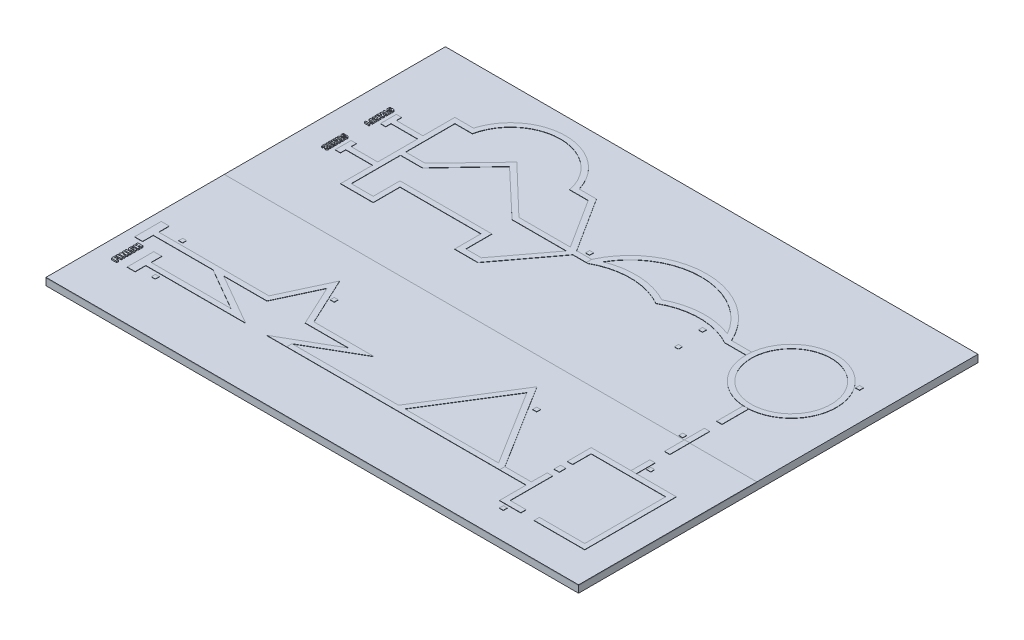
from build123d import *

# Parameters (mm, degrees)
SKETCH1_W              = 4000
SKETCH1_H              = 3000
BOSS_EXTRUDE1_DEPTH    = 50
SKETCH2_W              = 4000
SKETCH2_H              = 1500
BOSS_EXTRUDE2_DEPTH    = 5
BOSS_EXTRUDE4_DEPTH    = 2
SKETCH5_W              = 30
SKETCH5_H              = 30
BOSS_EXTRUDE6_DEPTH    = 2
SKETCH7_R              = 340
SKETCH7_R_2            = 300
BOSS_EXTRUDE8_DEPTH    = 2
SKETCH8_W              = 4000
SKETCH8_H              = 160.82
BOSS_EXTRUDE9_DEPTH    = 5
SKETCH9_W              = 4000
SKETCH9_H              = 1339.18
BOSS_EXTRUDE10_DEPTH   = 5
BOSS_EXTRUDE11_DEPTH   = 2
SKETCH11_W             = 40.058900335
SKETCH11_H             = 150
BOSS_EXTRUDE11_2_DEPTH = 2
SKETCH12_W             = 40.058900335
SKETCH12_H             = 150
BOSS_EXTRUDE12_DEPTH   = 2
BOSS_EXTRUDE12_2_DEPTH = 2
BOSS_EXTRUDE14_DEPTH   = 2
BOSS_EXTRUDE14_2_DEPTH = 2
BOSS_EXTRUDE17_DEPTH   = 2
BOSS_EXTRUDE19_DEPTH   = 2
SKETCH17_W             = 30
SKETCH17_H             = 30
BOSS_EXTRUDE20_DEPTH   = 2
BOSS_EXTRUDE20_2_DEPTH = 2
BOSS_EXTRUDE20_3_DEPTH = 2
BOSS_EXTRUDE20_4_DEPTH = 2
BOSS_EXTRUDE20_5_DEPTH = 2
BOSS_EXTRUDE20_6_DEPTH = 2
SKETCH17_W_2           = 29.999999997
BOSS_EXTRUDE20_7_DEPTH = 2
BOSS_EXTRUDE20_8_DEPTH = 2
BOSS_EXTRUDE20_9_DEPTH = 2
BOSS_EXTRUDE21_DEPTH   = 2
SKETCH21_W             = 30
SKETCH21_H             = 30
BOSS_EXTRUDE22_DEPTH   = 2
SKETCH26_W             = 40
SKETCH26_H             = 50
BOSS_EXTRUDE23_DEPTH   = 2
BOSS_EXTRUDE26_DEPTH   = 10
BOSS_EXTRUDE26_2_DEPTH = 10
BOSS_EXTRUDE26_3_DEPTH = 10
BOSS_EXTRUDE26_4_DEPTH = 10
BOSS_EXTRUDE26_5_DEPTH = 10
BOSS_EXTRUDE26_6_DEPTH = 10
BOSS_EXTRUDE27_DEPTH   = 10
BOSS_EXTRUDE27_2_DEPTH = 10
BOSS_EXTRUDE27_3_DEPTH = 10
BOSS_EXTRUDE27_4_DEPTH = 10
BOSS_EXTRUDE27_5_DEPTH = 10
BOSS_EXTRUDE27_6_DEPTH = 10
BOSS_EXTRUDE28_DEPTH   = 10
BOSS_EXTRUDE28_2_DEPTH = 10
SKETCH30_W             = 40
SKETCH30_H             = 12.820512821
BOSS_EXTRUDE28_3_DEPTH = 10
BOSS_EXTRUDE28_4_DEPTH = 10
SKETCH30_H_2           = 12.82051282
BOSS_EXTRUDE28_5_DEPTH = 10
BOSS_EXTRUDE28_6_DEPTH = 10


with BuildPart() as part:
    # Sketch1 → Boss-Extrude1 (new body)
    with BuildSketch(Plane(origin=(0, 0, 0), x_dir=(1, 0, 0), z_dir=(0, 1, 0))):
        with Locations((-732.874701715, 305.160298723)):
            Rectangle(SKETCH1_W, SKETCH1_H)
    extrude(amount=BOSS_EXTRUDE1_DEPTH)



with BuildPart() as body_2:
    # Sketch2 → Boss-Extrude2 (new body)
    with BuildSketch(Plane(origin=(0, 50, 0), x_dir=(1, 0, 0), z_dir=(0, 1, 0))):
        with Locations((-732.874701715, 1055.160298723)):
            Rectangle(SKETCH2_W, SKETCH2_H)
    extrude(amount=BOSS_EXTRUDE2_DEPTH)


with BuildPart() as body_3:
    # Sketch4 → Boss-Extrude4 (new body)
    with BuildSketch(Plane(origin=(0, 55, 0), x_dir=(1, 0, 0), z_dir=(0, 1, 0))):
        with BuildLine():
            Line((-2475.379900667, 1179.106217444), (-2475.379900667, 1059.106217444))
            Line((-2475.379900667, 1059.106217444), (-2435.393435028, 1059.106217444))
            Line((-2435.393435028, 1059.106217444), (-2435.393435028, 1099.106217444))
            Line((-2435.393435028, 1099.106217444), (-2235.393435028, 1099.106217444))
            Line((-2235.393435028, 1099.106217444), (-2235.393435028, 799.106217444))
            Line((-2235.393435028, 799.106217444), (-2435.393435028, 799.106217444))
            Line((-2435.393435028, 799.106217444), (-2435.393435028, 839.106217444))
            Line((-2435.393435028, 839.106217444), (-2475.379900667, 839.106217444))
            Line((-2475.379900667, 839.106217444), (-2475.379900667, 719.106217444))
            Line((-2475.379900667, 719.106217444), (-2435.379900667, 719.106217444))
            Line((-2435.379900667, 719.106217444), (-2435.379900667, 759.106217444))
            Line((-2435.379900667, 759.106217444), (-2234.217756911, 759.106217444))
            Line((-2234.217756911, 759.106217444), (-2234.217756911, 519.106217444))
            Line((-2234.217756911, 519.106217444), (-1989.15465458, 519.106217444))
            Line((-1989.15465458, 519.106217444), (-1989.15465458, 720.207561234))
            Line((-1989.15465458, 720.207561234), (-1380.546583307, 720.207561234))
            Line((-1380.546583307, 720.207561234), (-1380.546583307, 521.930666872))
            Line((-1380.546583307, 521.930666872), (-1205.713050264, 521.930666872))
            Line((-1205.713050264, 521.930666872), (-900.182963184, 929.106217444))
            Line((-900.182963184, 929.106217444), (-798.49467784, 929.106217444))
            Line((-798.49467784, 929.106217444), (-798.49467784, 969.106217444))
            Line((-798.49467784, 969.106217444), (-911.197148155, 969.106217444))
            Line((-911.197148155, 969.106217444), (-1173.136081249, 1379.824599867))
            Line((-1173.136081249, 1379.824599867), (-1303.266793146, 1379.824599867))
            ThreePointArc((-1303.266793146, 1379.824599867), (-1699.969056581, 1675.61325913), (-2096.134667144, 1379.106217444))
            Line((-2096.134667144, 1379.106217444), (-2236.134667144, 1379.106217444))
            Line((-2236.134667144, 1379.106217444), (-2236.134667144, 1139.106217444))
            Line((-2236.134667144, 1139.106217444), (-2435.379900667, 1139.106217444))
            Line((-2435.379900667, 1139.106217444), (-2435.379900667, 1179.106217444))
            Line((-2435.379900667, 1179.106217444), (-2475.379900667, 1179.106217444))
        make_face()
        with BuildLine():
            Line((-2195.393435028, 1339.106217444), (-2195.393435028, 969.106217444))
            Line((-2195.393435028, 969.106217444), (-2049.082061595, 969.106217444))
            Line((-2049.082061595, 969.106217444), (-1712.15457859, 1320.86104497))
            Line((-1712.15457859, 1320.86104497), (-1344.919891812, 969.106217444))
            Line((-1344.919891812, 969.106217444), (-958.623538224, 969.106217444))
            Line((-958.623538224, 969.106217444), (-1195.084067896, 1339.824599867))
            Line((-1195.084067896, 1339.824599867), (-1333.847820513, 1339.824599867))
            ThreePointArc((-1333.847820513, 1339.824599867), (-1699.415719286, 1635.58396494), (-2064.401247604, 1339.106217444))
            Line((-2064.401247604, 1339.106217444), (-2195.393435028, 1339.106217444))
        make_face(mode=Mode.SUBTRACT)
        Polygon((-1711.238925453, 1265.053320717), (-1356.237754207, 929.106217444), (-948.545125783, 929.106217444), (-1223.057324482, 565.027906535), (-1338.920797043, 565.027906535), (-1338.920797043, 760.207561234), (-2029.15465458, 760.207561234), (-2029.15465458, 559.106217444), (-2194.217756911, 559.106217444), (-2194.217756911, 929.106217444), (-2029.15465458, 929.106217444), align=None, mode=Mode.SUBTRACT)
    extrude(amount=BOSS_EXTRUDE4_DEPTH)


with BuildPart() as body_4:
    # Sketch5 → Boss-Extrude6 (new body)
    with BuildSketch(Plane(origin=(0, 55, 0), x_dir=(1, 0, 0), z_dir=(0, 1, 0))):
        with Locations((95.636875034, 726.892670667)):
            Rectangle(SKETCH5_W, SKETCH5_H)
    extrude(amount=BOSS_EXTRUDE6_DEPTH)


with BuildPart() as body_5:
    # Sketch7 → Boss-Extrude8 (new body)
    with BuildSketch(Plane(origin=(0, 55, 0), x_dir=(1, 0, 0), z_dir=(0, 1, 0))):
        with Locations(Location((743.3692149, 926.206526322, 0), (0, 0, 270))):
            Circle(SKETCH7_R)
        with Locations(Location((743.3692149, 926.206526322, 0), (0, 0, 270))):
            Circle(SKETCH7_R_2, mode=Mode.SUBTRACT)
    extrude(amount=BOSS_EXTRUDE8_DEPTH)


with BuildPart() as part_1:
    add(part.part)

    add(body_2.part)  # Boss-Extrude9 merges body 2
    # Sketch8 → Boss-Extrude9 (add)
    with BuildSketch(Plane(origin=(0, 50, 0), x_dir=(1, 0, 0), z_dir=(0, 1, 0))):
        with Locations((-732.874701715, 224.750298723)):
            Rectangle(SKETCH8_W, SKETCH8_H)
    extrude(amount=BOSS_EXTRUDE9_DEPTH)


with BuildPart() as body_5_2:
    # Sketch9 → Boss-Extrude10 (new body)
    with BuildSketch(Plane(origin=(0, 50, 0), x_dir=(1, 0, 0), z_dir=(0, 1, 0))):
        with Locations((-732.874701715, -525.249701277)):
            Rectangle(SKETCH9_W, SKETCH9_H)
    extrude(amount=BOSS_EXTRUDE10_DEPTH)


with BuildPart() as body_6:
    # Sketch11 → Boss-Extrude11 (new body)
    with BuildSketch(Plane(origin=(0, 55, 0), x_dir=(1, 0, 0), z_dir=(0, 1, 0))):
        Polygon((723.369012417, 586.795283284), (763.427912752, 586.79873525), (763.427912752, 386.206526322), (723.369012417, 386.206526322), align=None)
    extrude(amount=BOSS_EXTRUDE11_DEPTH)


with BuildPart() as body_7:
    # Sketch11 → Boss-Extrude11 2 (new body)
    with BuildSketch(Plane(origin=(0, 55, 0), x_dir=(1, 0, 0), z_dir=(0, 1, 0))):
        with Locations((743.398462585, 219.340298723)):
            Rectangle(SKETCH11_W, SKETCH11_H)
    extrude(amount=BOSS_EXTRUDE11_2_DEPTH)


with BuildPart() as body_8:
    # Sketch12 → Boss-Extrude12 (new body)
    with BuildSketch(Plane(origin=(0, 55, 0), x_dir=(1, 0, 0), z_dir=(0, 1, 0))):
        with Locations((743.398462585, -190.683370847)):
            Rectangle(SKETCH12_W, SKETCH12_H)
    extrude(amount=BOSS_EXTRUDE12_DEPTH)


with BuildPart() as body_9:
    # Sketch12 → Boss-Extrude12 2 (new body)
    with BuildSketch(Plane(origin=(0, 55, 0), x_dir=(1, 0, 0), z_dir=(0, 1, 0))):
        with Locations((743.398462585, 69.340298723)):
            Rectangle(SKETCH12_W, SKETCH12_H)
    extrude(amount=BOSS_EXTRUDE12_2_DEPTH)


with BuildPart() as body_10:
    # Sketch13 → Boss-Extrude14 (new body)
    with BuildSketch(Plane(origin=(0, 55, 0), x_dir=(1, 0, 0), z_dir=(0, 1, 0))):
        Polygon((743.521073992, -256.958661286), (423.521073992, -256.958661286), (423.521073992, -436.180069466), (463.521073992, -436.180069466), (463.521073992, -296.958661286), (743.521073992, -296.958661286), (1023.521073992, -296.958661286), (1023.521073992, -596.499644203), (1023.521073992, -904.786755482), (683.265324725, -904.786755482), (683.265324725, -944.786755482), (1063.265324725, -944.786755482), (1063.265324725, -256.958661286), align=None)
    extrude(amount=BOSS_EXTRUDE14_DEPTH)


with BuildPart() as body_11:
    # Sketch13 → Boss-Extrude14 2 (new body)
    with BuildSketch(Plane(origin=(0, 55, 0), x_dir=(1, 0, 0), z_dir=(0, 1, 0))):
        Polygon((423.430536519, -744.786755482), (223.430536519, -744.786755482), (223.430536519, -704.786755482), (421.968399169, -704.786755482), (423.521073992, -586.180069466), (463.521073992, -586.180069466), (463.430536519, -904.724186754), (583.265324725, -904.786755482), (583.265324725, -944.786755482), (423.430536519, -944.786755482), align=None)
    extrude(amount=BOSS_EXTRUDE14_2_DEPTH)


with BuildPart() as body_12:
    # Sketch15 → Boss-Extrude17 (new body)
    with BuildSketch(Plane(origin=(0, 55, 0), x_dir=(1, 0, 0), z_dir=(0, 1, 0))):
        Polygon((176.299134463, -704.785213849), (223.432648555, -704.785213849), (-175.219434884, -65.032871005), (-575.064649161, -704.785213849), (-527.894743501, -704.785213849), (-341.299502723, -406.232828605), (-175.271694139, -140.58833487), align=None)
        Polygon((-1375.219434884, -704.785213849), (-575.064649161, -704.785213849), (223.432648555, -704.785213849), (223.432648555, -744.789955896), (-1375.219434884, -744.789955896), align=None)
    extrude(amount=BOSS_EXTRUDE17_DEPTH)


with BuildPart() as body_13:
    # Sketch16 → Boss-Extrude19 (new body)
    with BuildSketch(Plane(origin=(0, 55, 0), x_dir=(1, 0, 0), z_dir=(0, 1, 0))):
        Polygon((-985.254400093, -480.225040086), (-1435.254400093, -480.225040086), (-1604.301704789, -117.701925271), (-1773.349009485, -480.225040086), (-2223.675005567, -479.274404849), (-2601.913698029, -479.274404849), (-2601.913698029, -400.225040086), (-2661.913698029, -400.225040086), (-2661.913698029, -600.225040086), (-2601.913698029, -600.225040086), (-2601.913698029, -520.225040086), (-2152.801836727, -520.225040086), (-1833.383974694, -704.785213849), (-2433.383974694, -704.785213849), (-2433.383974694, -624.785213849), (-2493.383974694, -624.785213849), (-2493.383974694, -824.785213849), (-2433.383974694, -824.785213849), (-2433.383974694, -744.785213849), (-1683.764383524, -744.785213849), (-2073.893067931, -520.130802954), (-1747.822255557, -520.130802954), (-1604.301704789, -212.349988597), (-1460.737210525, -520.225040086), (-1134.873991263, -520.225040086), (-1524.839026054, -744.785213849), (-1375.219434884, -744.785213849), (-1375.219434884, -704.785213849), align=None)
    extrude(amount=BOSS_EXTRUDE19_DEPTH)


with BuildPart() as body_14:
    # Sketch17 → Boss-Extrude20 (new body)
    with BuildSketch(Plane(origin=(0, 55, 0), x_dir=(1, 0, 0), z_dir=(0, 1, 0))):
        with Locations((-849.068743225, 1004.106217444)):
            Rectangle(SKETCH17_W, SKETCH17_H)
    extrude(amount=BOSS_EXTRUDE20_DEPTH)


with BuildPart() as body_15:
    # Sketch17 → Boss-Extrude20 2 (new body)
    with BuildSketch(Plane(origin=(0, 55, 0), x_dir=(1, 0, 0), z_dir=(0, 1, 0))):
        with Locations((1043.042073965, 1139.626951011)):
            Rectangle(SKETCH17_W, SKETCH17_H)
    extrude(amount=BOSS_EXTRUDE20_2_DEPTH)


with BuildPart() as body_16:
    # Sketch17 → Boss-Extrude20 3 (new body)
    with BuildSketch(Plane(origin=(0, 55, 0), x_dir=(1, 0, 0), z_dir=(0, 1, 0))):
        with Locations((688.369012417, 166.491540024)):
            Rectangle(SKETCH17_W, SKETCH17_H)
    extrude(amount=BOSS_EXTRUDE20_3_DEPTH)


with BuildPart() as body_17:
    # Sketch17 → Boss-Extrude20 4 (new body)
    with BuildSketch(Plane(origin=(0, 55, 0), x_dir=(1, 0, 0), z_dir=(0, 1, 0))):
        with Locations((790.521766601, -176.210034226)):
            Rectangle(SKETCH17_W, SKETCH17_H)
    extrude(amount=BOSS_EXTRUDE20_4_DEPTH)


with BuildPart() as body_18:
    # Sketch17 → Boss-Extrude20 5 (new body)
    with BuildSketch(Plane(origin=(0, 55, 0), x_dir=(1, 0, 0), z_dir=(0, 1, 0))):
        with Locations((486.624663775, -979.786755482)):
            Rectangle(SKETCH17_W, SKETCH17_H)
    extrude(amount=BOSS_EXTRUDE20_5_DEPTH)


with BuildPart() as body_19:
    # Sketch17 → Boss-Extrude20 6 (new body)
    with BuildSketch(Plane(origin=(0, 55, 0), x_dir=(1, 0, 0), z_dir=(0, 1, 0))):
        with Locations((-29.005950455, -213.277621773)):
            Rectangle(SKETCH17_W, SKETCH17_H)
    extrude(amount=BOSS_EXTRUDE20_6_DEPTH)


with BuildPart() as body_20:
    # Sketch17 → Boss-Extrude20 7 (new body)
    with BuildSketch(Plane(origin=(0, 55, 0), x_dir=(1, 0, 0), z_dir=(0, 1, 0))):
        with Locations((-2324.75333334, -781.917228294)):
            Rectangle(SKETCH17_W_2, SKETCH17_H)
    extrude(amount=BOSS_EXTRUDE20_7_DEPTH)


with BuildPart() as body_21:
    # Sketch17 → Boss-Extrude20 8 (new body)
    with BuildSketch(Plane(origin=(0, 55, 0), x_dir=(1, 0, 0), z_dir=(0, 1, 0))):
        with Locations((-2457.004882952, -444.274404849)):
            Rectangle(SKETCH17_W, SKETCH17_H)
    extrude(amount=BOSS_EXTRUDE20_8_DEPTH)


with BuildPart() as body_22:
    # Sketch17 → Boss-Extrude20 9 (new body)
    with BuildSketch(Plane(origin=(0, 55, 0), x_dir=(1, 0, 0), z_dir=(0, 1, 0))):
        with Locations((-1502.840161264, -260.229165309)):
            Rectangle(SKETCH17_W, SKETCH17_H)
    extrude(amount=BOSS_EXTRUDE20_9_DEPTH)


with BuildPart() as body_23:
    # Sketch19 → Boss-Extrude21 (new body)
    with BuildSketch(Plane(origin=(0, 55, 0), x_dir=(1, 0, 0), z_dir=(0, 1, 0))):
        with BuildLine():
            ThreePointArc((254.20270005, 966.820873755), (-271.375381412, 1307.575105925), (-798.429212335, 969.107935043))
            ThreePointArc((-798.429212335, 969.107935043), (-769.568076978, 983.427001607), (-739.933385067, 996.067643866))
            ThreePointArc((-739.933385067, 996.067643866), (-271.949010939, 1267.396373921), (195.083765328, 994.432933012))
            ThreePointArc((195.083765328, 994.432933012), (225.046240304, 981.489764811), (254.20270005, 966.820873755))
        make_face()
        with BuildLine():
            ThreePointArc((-271.268306307, 924.639934302), (-528.980868574, 994.493482074), (-787.863106524, 929.107935043))
            Line((-787.863106524, 929.107935043), (-798.429212335, 929.107935043))
            Line((-798.429212335, 929.107935043), (-798.429212335, 969.107935043))
            ThreePointArc((-798.429212335, 969.107935043), (-535.230567256, 1034.994476034), (-271.856122925, 969.814224971))
            ThreePointArc((-271.856122925, 969.814224971), (-8.452807224, 1034.028385185), (254.20270005, 966.820873755))
            Line((254.20270005, 966.820873755), (405.803703062, 966.820873755))
            Line((405.803703062, 966.820873755), (403.370230709, 927.037639504))
            Line((403.370230709, 927.037639504), (254.024571915, 927.037639504))
            Line((254.024571915, 927.037639504), (243.458483586, 927.056859697))
            ThreePointArc((243.458483586, 927.056859697), (-14.220827361, 993.128267971), (-271.268306307, 924.639934302))
        make_face()
    extrude(amount=BOSS_EXTRUDE21_DEPTH)


with BuildPart() as body_24:
    # Sketch21 → Boss-Extrude22 (new body)
    with BuildSketch(Plane(origin=(0, 55, 0), x_dir=(1, 0, 0), z_dir=(0, 1, 0))):
        with Locations((75.805981046, 927.467132629)):
            Rectangle(SKETCH21_W, SKETCH21_H)
    extrude(amount=BOSS_EXTRUDE22_DEPTH)


with BuildPart() as body_25:
    # Sketch26 → Boss-Extrude23 (new body)
    with BuildSketch(Plane(origin=(0, 55, 0), x_dir=(1, 0, 0), z_dir=(0, 1, 0))):
        with Locations((443.521073992, -511.180069466)):
            Rectangle(SKETCH26_W, SKETCH26_H)
    extrude(amount=BOSS_EXTRUDE23_DEPTH)


with BuildPart() as body_26:
    # Sketch28 → Boss-Extrude26 (new body)
    with BuildSketch(Plane(origin=(0, 55, 0), x_dir=(1, 0, 0), z_dir=(0, 1, 0))):
        with BuildLine():
            Line((-2529.217469559, 849.460199047), (-2529.217469559, 841.157729911))
            Line((-2529.217469559, 841.157729911), (-2530.344012769, 841.157729911))
            add(Edge.make_bspline(
                [(-2530.344012769, 841.157729911), (-2530.598693406, 841.154387234), (-2531.090347878, 841.147934281), (-2531.798206522, 841.109603371), (-2532.447101757, 841.04904615), (-2533.037637784, 840.966126257), (-2533.570489374, 840.854607729), (-2534.04185752, 840.702743121), (-2534.463301864, 840.548234166), (-2534.931695853, 840.293070221), (-2535.425061931, 839.887892247), (-2535.848054298, 839.243706263), (-2536.086659849, 838.45767685), (-2536.11564802, 837.892957635), (-2536.131049806, 837.592915097)],
                knots=[0, 0, 0, 0, 1.177719978, 2.273558366, 3.277152791, 4.190495585, 5.030331379, 5.790228402, 6.47934691, 7.102038157, 8.250261044, 9.391625857, 10.614137472, 12, 12, 12, 12], degree=3))
            add(Edge.make_bspline(
                [(-2536.131049806, 837.592915097), (-2536.120211481, 837.347324153), (-2536.099332103, 836.874208047), (-2535.910817473, 836.204678247), (-2535.594535034, 835.617009827), (-2535.157008896, 835.118392681), (-2534.609166917, 834.719306239), (-2533.959879188, 834.442815118), (-2533.225987184, 834.269235525), (-2532.706168881, 834.252748388), (-2532.435062152, 834.244149664)],
                knots=[0, 0, 0, 0, 1.043700438, 2.010625803, 2.931524219, 3.862518521, 4.81066928, 5.791073107, 6.847953328, 8, 8, 8, 8], degree=3))
            add(Edge.make_bspline(
                [(-2532.435062152, 834.244149664), (-2532.199502607, 834.254928999), (-2531.722377044, 834.276762527), (-2531.019878412, 834.494918868), (-2530.327181503, 834.82298022), (-2529.639333689, 835.277864466), (-2528.972014198, 835.873087184), (-2528.305876934, 836.588587684), (-2527.648750854, 837.433822571), (-2527.244940076, 838.060198507), (-2527.033827584, 838.387668183)],
                knots=[0, 0, 0, 0, 0.794397, 1.609050133, 2.464853986, 3.381374859, 4.385952977, 5.481109051, 6.683122458, 8, 8, 8, 8], degree=3))
            add(Edge.make_bspline(
                [(-2527.033827584, 838.387668183), (-2526.898305573, 838.584552555), (-2526.664451327, 838.924292542), (-2526.446472215, 839.274402687), (-2526.354815238, 839.4216188)],
                knots=[0, 0, 0, 0, 1.159029723, 2, 2, 2, 2], degree=3))
            add(Edge.make_bspline(
                [(-2526.354815238, 839.4216188), (-2526.319203098, 839.481025767), (-2526.228199364, 839.632835117), (-2526.129436055, 839.779735339), (-2526.069321411, 839.869149664)],
                knots=[0, 0, 0, 0, 0.782652281, 2, 2, 2, 2], degree=3))
            add(Edge.make_bspline(
                [(-2526.069321411, 839.869149664), (-2525.768092737, 840.325935403), (-2525.192278251, 841.199105417), (-2524.332453051, 842.42481063), (-2523.539589221, 843.524074856), (-2522.804731488, 844.486795755), (-2522.122803088, 845.308648498), (-2521.505837773, 845.998710366), (-2520.950647202, 846.564264583), (-2520.570591968, 846.863093735), (-2520.398025115, 846.998779294)],
                knots=[0, 0, 0, 0, 1.436232457, 2.745434041, 3.92980014, 4.993907842, 5.924049624, 6.732005645, 7.424257904, 8, 8, 8, 8], degree=3))
            add(Edge.make_bspline(
                [(-2520.398025115, 846.998779294), (-2520.15368023, 847.159892823), (-2519.659499297, 847.485740586), (-2518.866419291, 847.899186016), (-2518.025155044, 848.245759518), (-2517.14444508, 848.541394354), (-2516.217707199, 848.770342123), (-2515.248927513, 848.941819607), (-2514.23766649, 849.043407712), (-2513.548975835, 849.053722183), (-2513.198951041, 849.058964479)],
                knots=[0, 0, 0, 0, 0.923295691, 1.867340605, 2.817091872, 3.79254772, 4.796631, 5.826918215, 6.895538223, 8, 8, 8, 8], degree=3))
            add(Edge.make_bspline(
                [(-2513.198951041, 849.058964479), (-2512.776620221, 849.051522137), (-2511.952416468, 849.036997962), (-2510.753345198, 848.881940433), (-2509.6199072, 848.657673343), (-2508.555748549, 848.325654226), (-2507.566628438, 847.888493978), (-2506.638168745, 847.375482384), (-2505.793579445, 846.746875626), (-2505.012185904, 846.041282481), (-2504.320760664, 845.245000389), (-2503.712226265, 844.379483012), (-2503.190539459, 843.443368908), (-2502.778857288, 842.427853545), (-2502.450877153, 841.346012523), (-2502.223741708, 840.193253082), (-2502.081731472, 838.969930254), (-2502.06536292, 838.130870879), (-2502.056975732, 837.700939788)],
                knots=[0, 0, 0, 0, 1.12365765, 2.192884841, 3.213430979, 4.196588209, 5.153208562, 6.088267806, 7.014030518, 7.949465716, 8.88600284, 9.81489997, 10.761915705, 11.732088561, 12.726317757, 13.766992705, 14.855814866, 16, 16, 16, 16], degree=3))
            add(Edge.make_bspline(
                [(-2502.056975732, 837.700939788), (-2502.06543179, 837.235046823), (-2502.08191645, 836.326812003), (-2502.221942273, 835.008271543), (-2502.45066602, 833.773765982), (-2502.775851133, 832.624175943), (-2503.188806697, 831.556545204), (-2503.70176094, 830.575806056), (-2504.306512467, 829.681772902), (-2505.003291534, 828.876298342), (-2505.787982858, 828.161118729), (-2506.658956697, 827.540969807), (-2507.611012013, 827.013621032), (-2508.649498315, 826.592395568), (-2509.762404181, 826.245354636), (-2510.967498064, 826.026191535), (-2512.248393022, 825.870741298), (-2513.131563864, 825.856431074), (-2513.58475351, 825.849087936)],
                knots=[0, 0, 0, 0, 1.184636193, 2.309388464, 3.367815812, 4.374165039, 5.34352283, 6.273960629, 7.182927026, 8.082595682, 8.976275467, 9.876609733, 10.79596733, 11.737423104, 12.722370085, 13.75509706, 14.848052133, 16, 16, 16, 16], degree=3))
            add(Edge.make_bspline(
                [(-2513.58475351, 825.849087936), (-2513.679920163, 825.85151764), (-2513.898608275, 825.857100974), (-2514.240900885, 825.869370609), (-2514.582364509, 825.897558917), (-2514.801276182, 825.901420751), (-2514.896481905, 825.903100282)],
                knots=[0, 0, 0, 0, 0.870075326, 1.999388701, 3.129924674, 4, 4, 4, 4], degree=3))
            Line((-2514.896481905, 825.903100282), (-2514.896481905, 834.244149664))
            Line((-2514.896481905, 834.244149664), (-2514.394938695, 834.244149664))
            add(Edge.make_bspline(
                [(-2514.394938695, 834.244149664), (-2513.974937427, 834.24958486), (-2513.188233845, 834.259765515), (-2512.091206486, 834.422349227), (-2511.145936863, 834.642748023), (-2510.366749908, 834.99331576), (-2509.742187116, 835.433271956), (-2509.294544723, 835.982166043), (-2509.011282679, 836.626679598), (-2508.984417284, 837.091000986), (-2508.970555979, 837.330569418)],
                knots=[0, 0, 0, 0, 1.443087324, 2.703044148, 3.808142973, 4.770264469, 5.624980035, 6.411196345, 7.180250557, 8, 8, 8, 8], degree=3))
            add(Edge.make_bspline(
                [(-2508.970555979, 837.330569418), (-2508.982125116, 837.535131656), (-2509.00456817, 837.931963447), (-2509.187297637, 838.493316958), (-2509.49231976, 838.989077914), (-2509.911250324, 839.410326773), (-2510.42848283, 839.753683598), (-2511.028899566, 839.998613774), (-2511.705020542, 840.148741306), (-2512.179605194, 840.162758426), (-2512.427346102, 840.17007559)],
                knots=[0, 0, 0, 0, 0.976077678, 1.893500275, 2.787397437, 3.734880841, 4.709951733, 5.734961374, 6.817612996, 8, 8, 8, 8], degree=3))
            add(Edge.make_bspline(
                [(-2512.427346102, 840.17007559), (-2512.642500619, 840.156340897), (-2513.088289079, 840.127883358), (-2513.749484625, 839.894553565), (-2514.414100847, 839.529500396), (-2515.086182669, 839.025788549), (-2515.775741527, 838.391259005), (-2516.456682958, 837.599622771), (-2517.16406964, 836.681570765), (-2517.604752655, 835.999256681), (-2517.83629672, 835.640754603)],
                knots=[0, 0, 0, 0, 0.703837596, 1.458313231, 2.273116492, 3.183655264, 4.203891538, 5.33879556, 6.601747579, 8, 8, 8, 8], degree=3))
            add(Edge.make_bspline(
                [(-2517.83629672, 835.640754603), (-2517.921191008, 835.512165485), (-2518.080761063, 835.270465214), (-2518.304524337, 834.930957518), (-2518.497480183, 834.637783311), (-2518.615637439, 834.457639992), (-2518.669630053, 834.375322504)],
                knots=[0, 0, 0, 0, 1.220332035, 2.293775616, 3.220331308, 4, 4, 4, 4], degree=3))
            add(Edge.make_bspline(
                [(-2518.669630053, 834.375322504), (-2518.756083236, 834.230662497), (-2518.960759074, 833.8881834), (-2519.182172, 833.556248626), (-2519.310062152, 833.364520035)],
                knots=[0, 0, 0, 0, 0.844781522, 2, 2, 2, 2], degree=3))
            add(Edge.make_bspline(
                [(-2519.310062152, 833.364520035), (-2519.557390716, 832.974726498), (-2520.032909382, 832.22530193), (-2520.75209835, 831.168795358), (-2521.43293373, 830.214917204), (-2522.100313842, 829.385086328), (-2522.721465274, 828.650094796), (-2523.325032176, 828.037940629), (-2523.881837538, 827.513169486), (-2524.273383959, 827.24162853), (-2524.45666709, 827.114520035)],
                knots=[0, 0, 0, 0, 1.35992493, 2.614617883, 3.765034212, 4.811153046, 5.751390674, 6.598026131, 7.343735132, 8, 8, 8, 8], degree=3))
            add(Edge.make_bspline(
                [(-2524.45666709, 827.114520035), (-2524.68868634, 826.977044812), (-2525.158359221, 826.698755903), (-2525.907653475, 826.346691931), (-2526.702559192, 826.044488216), (-2527.539232645, 825.78870965), (-2528.420153734, 825.599676271), (-2529.337335028, 825.459780728), (-2530.290960422, 825.374253613), (-2530.940547037, 825.361651195), (-2531.269938695, 825.355260776)],
                knots=[0, 0, 0, 0, 0.907563123, 1.837165611, 2.782762433, 3.768921106, 4.77952579, 5.813128795, 6.891083784, 8, 8, 8, 8], degree=3))
            add(Edge.make_bspline(
                [(-2531.269938695, 825.355260776), (-2531.748731972, 825.362958776), (-2532.6778568, 825.377897172), (-2534.03030087, 825.527549017), (-2535.295120437, 825.771915506), (-2536.480034717, 826.110520706), (-2537.577867001, 826.551901875), (-2538.596847574, 827.081720333), (-2539.523729664, 827.723285393), (-2540.36407029, 828.456326944), (-2541.120842815, 829.277622744), (-2541.767506936, 830.193622909), (-2542.320824434, 831.188835634), (-2542.766336588, 832.266823934), (-2543.117062078, 833.42705915), (-2543.355291947, 834.671147052), (-2543.518523829, 835.996524698), (-2543.531689699, 836.908230902), (-2543.538457213, 837.376865714)],
                knots=[0, 0, 0, 0, 1.174009666, 2.278230672, 3.332351982, 4.330626645, 5.295924673, 6.229980798, 7.141676959, 8.053831363, 8.960274009, 9.874041342, 10.797448638, 11.747620747, 12.729535404, 13.765087567, 14.851211321, 16, 16, 16, 16], degree=3))
            add(Edge.make_bspline(
                [(-2543.538457213, 837.376865714), (-2543.530946913, 837.868533692), (-2543.516401196, 838.820781076), (-2543.365397877, 840.200749538), (-2543.129423086, 841.486343475), (-2542.800854666, 842.682284273), (-2542.368436707, 843.781389587), (-2541.842313638, 844.788429658), (-2541.212959537, 845.696342921), (-2540.490372041, 846.512156), (-2539.675724357, 847.238461866), (-2538.757017838, 847.852994952), (-2537.752299465, 848.383868345), (-2536.654473469, 848.81337962), (-2535.462150033, 849.145190434), (-2534.181110769, 849.378786495), (-2532.806508918, 849.530940909), (-2531.859359952, 849.545350469), (-2531.370247337, 849.55279164)],
                knots=[0, 0, 0, 0, 1.195691109, 2.315777684, 3.372408741, 4.372856355, 5.327957607, 6.240397254, 7.130794827, 8.008437614, 8.8860804, 9.778103389, 10.690543035, 11.645644288, 12.640066768, 13.696697826, 14.810562866, 16, 16, 16, 16], degree=3))
            add(Edge.make_bspline(
                [(-2531.370247337, 849.55279164), (-2531.239045048, 849.55423743), (-2530.971398239, 849.557186779), (-2530.621869025, 849.537439691), (-2530.302722485, 849.53057543), (-2529.996697902, 849.513070092), (-2529.628861085, 849.490488542), (-2529.361482301, 849.470802263), (-2529.217469559, 849.460199047)],
                knots=[0, 0, 0, 0, 1.095435618, 2.234639741, 2.922307423, 3.761094255, 4.79410419, 6, 6, 6, 6], degree=3))
        make_face()
    extrude(amount=BOSS_EXTRUDE26_DEPTH)


with BuildPart() as body_27:
    # Sketch28 → Boss-Extrude26 2 (new body)
    with BuildSketch(Plane(origin=(0, 55, 0), x_dir=(1, 0, 0), z_dir=(0, 1, 0))):
        Polygon((-2543.044630053, 814.984890405), (-2510.945864621, 814.984890405), (-2510.945864621, 822.392297813), (-2503.044630053, 822.392297813), (-2503.044630053, 797.700939788), (-2510.945864621, 797.700939788), (-2510.945864621, 805.602174356), (-2543.044630053, 805.602174356), align=None)
    extrude(amount=BOSS_EXTRUDE26_2_DEPTH)


with BuildPart() as body_28:
    # Sketch28 → Boss-Extrude26 3 (new body)
    with BuildSketch(Plane(origin=(0, 55, 0), x_dir=(1, 0, 0), z_dir=(0, 1, 0))):
        Polygon((-2543.044630053, 796.713285467), (-2503.044630053, 787.932421269), (-2503.044630053, 776.744149664), (-2543.044630053, 768.071310158), (-2543.044630053, 777.477174356), (-2535.637222645, 778.657729911), (-2535.637222645, 786.04970522), (-2543.044630053, 787.230260776), align=None)
        Polygon((-2528.229815238, 785.085199047), (-2528.229815238, 779.67624843), (-2510.729815238, 782.369149664), align=None, mode=Mode.SUBTRACT)
    extrude(amount=BOSS_EXTRUDE26_3_DEPTH)


with BuildPart() as body_29:
    # Sketch28 → Boss-Extrude26 4 (new body)
    with BuildSketch(Plane(origin=(0, 55, 0), x_dir=(1, 0, 0), z_dir=(0, 1, 0))):
        with BuildLine():
            Line((-2543.044630053, 764.614520035), (-2503.044630053, 764.614520035))
            Line((-2503.044630053, 764.614520035), (-2503.044630053, 754.04353238))
            add(Edge.make_bspline(
                [(-2503.044630053, 754.04353238), (-2503.04599748, 753.629426967), (-2503.048630648, 752.83201086), (-2503.071805232, 751.679594274), (-2503.109959778, 750.614638624), (-2503.161487211, 749.63686179), (-2503.234460675, 748.747296403), (-2503.304278884, 747.945763171), (-2503.406353105, 747.233129965), (-2503.555699738, 746.415772976), (-2503.791774979, 745.495562169), (-2504.159355676, 744.49077127), (-2504.60916647, 743.585070356), (-2504.999163477, 743.063682291), (-2505.189691781, 742.808964479)],
                knots=[0, 0, 0, 0, 1.279972199, 2.46475997, 3.562577706, 4.573758237, 5.490801962, 6.321413667, 7.060078042, 7.71497536, 8.889261006, 9.990957918, 11.018506874, 12, 12, 12, 12], degree=3))
            add(Edge.make_bspline(
                [(-2505.189691781, 742.808964479), (-2505.432510579, 742.537274385), (-2505.914185716, 741.998327795), (-2506.754802683, 741.309787184), (-2507.666814091, 740.715328151), (-2508.675286375, 740.247440312), (-2509.765211914, 739.871556235), (-2510.953808986, 739.613762083), (-2512.238095809, 739.459920915), (-2513.126488923, 739.439743219), (-2513.58475351, 739.42933485)],
                knots=[0, 0, 0, 0, 0.932521938, 1.849826441, 2.774911843, 3.715412128, 4.690874296, 5.723890418, 6.825902182, 8, 8, 8, 8], degree=3))
            add(Edge.make_bspline(
                [(-2513.58475351, 739.42933485), (-2514.141070435, 739.443708646), (-2515.212233838, 739.47138475), (-2516.751088755, 739.694201752), (-2518.151135533, 740.070618418), (-2519.422730543, 740.596613215), (-2520.568252685, 741.294039527), (-2521.595068835, 742.165112525), (-2522.524640896, 743.19594729), (-2523.032234851, 743.986760701), (-2523.291543633, 744.390754603)],
                knots=[0, 0, 0, 0, 1.163395974, 2.240067012, 3.243768905, 4.189054691, 5.109028123, 6.036959518, 6.997163715, 8, 8, 8, 8], degree=3))
            add(Edge.make_bspline(
                [(-2523.291543633, 744.390754603), (-2523.463992647, 744.050872607), (-2523.808019315, 743.37282599), (-2524.557348659, 742.494585809), (-2525.45446688, 741.734760169), (-2526.525386252, 741.119000082), (-2527.745980349, 740.61525462), (-2529.134253764, 740.250216716), (-2530.68404565, 740.015888525), (-2531.773228208, 739.954989679), (-2532.342469559, 739.92316201)],
                knots=[0, 0, 0, 0, 0.855679306, 1.707034986, 2.578428973, 3.492329, 4.476538106, 5.544354803, 6.716601933, 8, 8, 8, 8], degree=3))
            add(Edge.make_bspline(
                [(-2532.342469559, 739.92316201), (-2532.37076174, 739.92316201), (-2532.41448602, 739.92316201), (-2532.4582103, 739.92316201), (-2532.473642399, 739.92316201)],
                knots=[0, 0, 0, 0, 1.294117647, 2, 2, 2, 2], degree=3))
            add(Edge.make_bspline(
                [(-2532.473642399, 739.92316201), (-2532.612528266, 739.917991242), (-2532.915987122, 739.906693364), (-2533.414869094, 739.888751872), (-2533.996363738, 739.886684451), (-2534.41296073, 739.875230618), (-2534.634136226, 739.869149664)],
                knots=[0, 0, 0, 0, 0.77168713, 1.6860988, 2.771526786, 4, 4, 4, 4], degree=3))
            add(Edge.make_bspline(
                [(-2534.634136226, 739.869149664), (-2535.166854907, 739.854415008), (-2536.182445925, 739.826324413), (-2537.627821418, 739.69526251), (-2538.918636995, 739.502280692), (-2540.050818827, 739.231743148), (-2541.036417257, 738.910604251), (-2541.858198448, 738.497760249), (-2542.54869423, 738.037646656), (-2542.884844915, 737.64206238), (-2543.044630053, 737.454026208)],
                knots=[0, 0, 0, 0, 1.420468293, 2.708023747, 3.866945781, 4.896439486, 5.809354244, 6.621993836, 7.344981536, 8, 8, 8, 8], degree=3))
            Line((-2543.044630053, 737.454026208), (-2543.044630053, 748.379952134))
            add(Edge.make_bspline(
                [(-2543.044630053, 748.379952134), (-2542.626239784, 748.544833043), (-2541.788876573, 748.874824483), (-2540.451493892, 749.18401915), (-2539.045622529, 749.373549646), (-2538.078728479, 749.395105339), (-2537.58166709, 749.406186701)],
                knots=[0, 0, 0, 0, 0.96314252, 1.927626365, 2.934633097, 4, 4, 4, 4], degree=3))
            add(Edge.make_bspline(
                [(-2537.58166709, 749.406186701), (-2537.23185469, 749.401980317), (-2536.467771279, 749.392792454), (-2535.498123495, 749.364091759), (-2534.711554271, 749.324429888), (-2534.212078459, 749.328041976), (-2533.831840097, 749.302713314), (-2533.618209498, 749.30495871), (-2533.530741164, 749.305878059)],
                knots=[0, 0, 0, 0, 1.55387056, 3.394066979, 4.308652055, 5.051318361, 5.611574359, 6, 6, 6, 6], degree=3))
            add(Edge.make_bspline(
                [(-2533.530741164, 749.305878059), (-2533.240063504, 749.309291233), (-2532.684161413, 749.315818705), (-2531.886016405, 749.352486584), (-2531.159413633, 749.419556863), (-2530.503184165, 749.521237805), (-2529.916232236, 749.639281449), (-2529.401382584, 749.792725681), (-2528.959796127, 749.977891091), (-2528.577611869, 750.187309921), (-2528.254088157, 750.439211424), (-2527.979148485, 750.735832507), (-2527.759065717, 751.082971182), (-2527.558390474, 751.463431799), (-2527.416642579, 751.896801837), (-2527.318628121, 752.37071203), (-2527.25525307, 752.887025141), (-2527.246660002, 753.246010172), (-2527.242160917, 753.433964479)],
                knots=[0, 0, 0, 0, 1.59666936, 3.053526152, 4.387594003, 5.602403724, 6.699637585, 7.673930306, 8.547674404, 9.325719447, 10.060490722, 10.7903562, 11.534842097, 12.311988778, 13.147430868, 14.02856766, 14.967814343, 16, 16, 16, 16], degree=3))
            Line((-2527.242160917, 753.433964479), (-2527.242160917, 755.231803985))
            Line((-2527.242160917, 755.231803985), (-2543.044630053, 755.231803985))
            Line((-2543.044630053, 755.231803985), (-2543.044630053, 764.614520035))
        make_face()
        with BuildLine():
            add(Edge.make_bspline(
                [(-2519.780741164, 755.231803985), (-2519.782422639, 755.144310728), (-2519.786284249, 754.943377082), (-2519.813899619, 754.635375733), (-2519.826361971, 754.336812055), (-2519.832285997, 754.151559254), (-2519.83475351, 754.074396578)],
                knots=[0, 0, 0, 0, 0.905964871, 2.080604048, 3.200520975, 4, 4, 4, 4], degree=3))
            add(Edge.make_bspline(
                [(-2519.83475351, 754.074396578), (-2519.834008714, 753.84265588), (-2519.832582274, 753.39882356), (-2519.760549248, 752.761431697), (-2519.686459225, 752.170702488), (-2519.551715883, 751.635491216), (-2519.3942229, 751.145389935), (-2519.18141352, 750.718562116), (-2518.954172804, 750.328714464), (-2518.669900496, 750.002469504), (-2518.344896018, 749.718138241), (-2517.975848388, 749.470231133), (-2517.549460333, 749.271262451), (-2517.077696353, 749.100133263), (-2516.552305085, 748.971279079), (-2515.978959776, 748.883023088), (-2515.358450206, 748.815357379), (-2514.927553267, 748.813181752), (-2514.70358067, 748.812050899)],
                knots=[0, 0, 0, 0, 1.296274315, 2.482638743, 3.58840355, 4.625666905, 5.568256437, 6.463460303, 7.290773518, 8.087314111, 8.872977683, 9.703667446, 10.566676523, 11.50042563, 12.509726347, 13.589208229, 14.746913134, 16, 16, 16, 16], degree=3))
            add(Edge.make_bspline(
                [(-2514.70358067, 748.812050899), (-2514.495008321, 748.813081492), (-2514.094836526, 748.815058811), (-2513.518208721, 748.883818411), (-2512.987778083, 748.969536156), (-2512.50198716, 749.102803116), (-2512.065274034, 749.270841083), (-2511.669054423, 749.470319513), (-2511.330642317, 749.720867758), (-2511.028953167, 750.002866492), (-2510.770339679, 750.332595586), (-2510.555045178, 750.716994141), (-2510.372520061, 751.150077045), (-2510.214131222, 751.634116554), (-2510.104792101, 752.173205979), (-2510.020564576, 752.760580895), (-2509.963744908, 753.399433675), (-2509.960109487, 753.842784782), (-2509.9582103, 754.074396578)],
                knots=[0, 0, 0, 0, 1.210895922, 2.323253285, 3.369921311, 4.330697329, 5.243797547, 6.086025591, 6.899109388, 7.681393902, 8.479646494, 9.323067027, 10.233595299, 11.207187618, 12.277070863, 13.424709115, 14.654637967, 16, 16, 16, 16], degree=3))
            add(Edge.make_bspline(
                [(-2509.9582103, 754.074396578), (-2509.960024436, 754.151597784), (-2509.964383419, 754.337095898), (-2509.992547358, 754.634740676), (-2510.004146337, 754.943668624), (-2510.009771487, 755.144354929), (-2510.012222645, 755.231803985)],
                knots=[0, 0, 0, 0, 0.799464698, 1.920944002, 3.094051365, 4, 4, 4, 4], degree=3))
            Line((-2510.012222645, 755.231803985), (-2519.780741164, 755.231803985))
        make_face(mode=Mode.SUBTRACT)
    extrude(amount=BOSS_EXTRUDE26_4_DEPTH)


with BuildPart() as body_30:
    # Sketch28 → Boss-Extrude26 5 (new body)
    with BuildSketch(Plane(origin=(0, 55, 0), x_dir=(1, 0, 0), z_dir=(0, 1, 0))):
        Polygon((-2543.044630053, 728.565137319), (-2510.945864621, 728.565137319), (-2510.945864621, 735.972544726), (-2503.044630053, 735.972544726), (-2503.044630053, 711.281186701), (-2510.945864621, 711.281186701), (-2510.945864621, 719.182421269), (-2543.044630053, 719.182421269), align=None)
    extrude(amount=BOSS_EXTRUDE26_5_DEPTH)


with BuildPart() as body_31:
    # Sketch28 → Boss-Extrude26 6 (new body)
    with BuildSketch(Plane(origin=(0, 55, 0), x_dir=(1, 0, 0), z_dir=(0, 1, 0))):
        with BuildLine():
            Line((-2543.044630053, 709.305878059), (-2542.396481905, 709.305878059))
            add(Edge.make_bspline(
                [(-2542.396481905, 709.305878059), (-2542.013040674, 709.300419739), (-2541.244840171, 709.289484335), (-2540.098071326, 709.186002374), (-2538.959194559, 709.016370156), (-2537.828259415, 708.775463744), (-2536.700301637, 708.465116862), (-2535.566940534, 708.087687611), (-2534.433507902, 707.621838229), (-2533.685984062, 707.264720892), (-2533.306975732, 707.083655837)],
                knots=[0, 0, 0, 0, 0.974236617, 1.951822076, 2.92333613, 3.898887389, 4.888331226, 5.894918923, 6.932685191, 8, 8, 8, 8], degree=3))
            add(Edge.make_bspline(
                [(-2533.306975732, 707.083655837), (-2532.903670113, 706.894923384), (-2532.086430114, 706.512484601), (-2530.884338921, 705.853853687), (-2529.685152764, 705.115067335), (-2528.482212774, 704.308735249), (-2527.284829993, 703.414117563), (-2526.081912517, 702.453344228), (-2524.883709634, 701.409141066), (-2524.104211332, 700.669357511), (-2523.7082103, 700.29353238)],
                knots=[0, 0, 0, 0, 0.904295356, 1.83242261, 2.782191369, 3.764605085, 4.772917899, 5.817278122, 6.891132778, 8, 8, 8, 8], degree=3))
            add(Edge.make_bspline(
                [(-2523.7082103, 700.29353238), (-2523.600426806, 700.18783394), (-2523.400440522, 699.991716355), (-2523.121711897, 699.72523674), (-2522.898171706, 699.496003354), (-2522.759491494, 699.364671878), (-2522.697407831, 699.305878059)],
                knots=[0, 0, 0, 0, 1.281829006, 2.378362506, 3.274033433, 4, 4, 4, 4], degree=3))
            Line((-2522.697407831, 699.305878059), (-2522.427346102, 699.066680529))
            add(Edge.make_bspline(
                [(-2522.427346102, 699.066680529), (-2521.984327302, 698.665348826), (-2521.132777249, 697.893927766), (-2519.830857003, 696.86383098), (-2518.573084687, 695.98590412), (-2517.355559303, 695.263644723), (-2516.179644517, 694.698929474), (-2515.044005046, 694.301865695), (-2513.951287459, 694.043854631), (-2513.231102946, 694.012438771), (-2512.882593016, 693.997236084)],
                knots=[0, 0, 0, 0, 1.299116998, 2.497102033, 3.60599517, 4.631026631, 5.57136613, 6.436009289, 7.243157434, 8, 8, 8, 8], degree=3))
            add(Edge.make_bspline(
                [(-2512.882593016, 693.997236084), (-2512.586383031, 694.006112958), (-2512.024185476, 694.022960996), (-2511.235084143, 694.147063312), (-2510.553386754, 694.372427898), (-2509.981363786, 694.684923406), (-2509.527276446, 695.094408954), (-2509.201959692, 695.587793941), (-2508.9994772, 696.160762998), (-2508.980443302, 696.57009754), (-2508.970555979, 696.782729911)],
                knots=[0, 0, 0, 0, 1.310197668, 2.486715374, 3.519317982, 4.471911657, 5.349754202, 6.195451272, 7.062611543, 8, 8, 8, 8], degree=3))
            add(Edge.make_bspline(
                [(-2508.970555979, 696.782729911), (-2508.973794892, 696.937474787), (-2508.98004772, 697.236214806), (-2509.06231127, 697.66571335), (-2509.182471453, 698.065098691), (-2509.363913971, 698.429511518), (-2509.588888986, 698.767154809), (-2509.868397161, 699.068047557), (-2510.199201402, 699.334070605), (-2510.580998334, 699.566238342), (-2511.018042184, 699.764073054), (-2511.50672489, 699.944717024), (-2512.058347533, 700.086243713), (-2512.6680783, 700.211971569), (-2513.338939646, 700.298971267), (-2514.06692688, 700.37123818), (-2514.854989653, 700.406528879), (-2515.400573778, 700.413416951), (-2515.683518942, 700.416989171)],
                knots=[0, 0, 0, 0, 0.86168308, 1.663507234, 2.430178601, 3.180713422, 3.924640324, 4.685925805, 5.461004054, 6.285098309, 7.170683957, 8.132659099, 9.186879494, 10.34301984, 11.602715954, 12.957167607, 14.421957914, 16, 16, 16, 16], degree=3))
            Line((-2515.683518942, 700.416989171), (-2516.377963386, 700.416989171))
            Line((-2516.377963386, 700.416989171), (-2516.377963386, 708.812050899))
            Line((-2516.377963386, 708.812050899), (-2515.320864621, 708.812050899))
            add(Edge.make_bspline(
                [(-2515.320864621, 708.812050899), (-2514.800860006, 708.805204547), (-2513.789256648, 708.791885833), (-2512.319871027, 708.630120282), (-2510.940855877, 708.389203709), (-2509.655502448, 708.044780343), (-2508.468589814, 707.593463536), (-2507.368674654, 707.056053797), (-2506.37115344, 706.401900774), (-2505.462508173, 705.660175152), (-2504.653688793, 704.823233564), (-2503.959884372, 703.891908726), (-2503.36477406, 702.879485572), (-2502.88908472, 701.773502301), (-2502.508435444, 700.58572426), (-2502.25260152, 699.306885679), (-2502.085128662, 697.947162345), (-2502.0665282, 697.009597064), (-2502.056975732, 696.528100282)],
                knots=[0, 0, 0, 0, 1.210454729, 2.354786924, 3.438046855, 4.468224474, 5.448287948, 6.391186782, 7.313232317, 8.219738629, 9.117795496, 10.016251766, 10.918215154, 11.84629144, 12.814273546, 13.817473722, 14.879140044, 16, 16, 16, 16], degree=3))
            add(Edge.make_bspline(
                [(-2502.056975732, 696.528100282), (-2502.065651316, 696.093087776), (-2502.08258708, 695.24389204), (-2502.220462893, 694.006398826), (-2502.461019296, 692.842331049), (-2502.790038249, 691.750419712), (-2503.21800376, 690.732326707), (-2503.733346862, 689.783471849), (-2504.35795529, 688.914926458), (-2505.067240596, 688.121673262), (-2505.85387185, 687.40575968), (-2506.729344571, 686.795096809), (-2507.668742635, 686.268988653), (-2508.686001946, 685.84108643), (-2509.772100806, 685.510512758), (-2510.933452983, 685.284614816), (-2512.163431716, 685.130181813), (-2513.010688027, 685.115756483), (-2513.445864621, 685.108347195)],
                knots=[0, 0, 0, 0, 1.140882543, 2.227137331, 3.260502828, 4.255016048, 5.213546317, 6.152575602, 7.081149646, 8.012879908, 8.939589442, 9.86425844, 10.80655384, 11.758867167, 12.753380387, 13.778786937, 14.859117457, 16, 16, 16, 16], degree=3))
            add(Edge.make_bspline(
                [(-2513.445864621, 685.108347195), (-2513.966240237, 685.125859136), (-2514.999595803, 685.160634133), (-2516.530648243, 685.403413846), (-2518.017489544, 685.819225628), (-2519.481393124, 686.384171578), (-2520.916121507, 687.149466855), (-2522.359441831, 688.082677751), (-2523.809072616, 689.201545329), (-2524.735639876, 690.054738622), (-2525.212839929, 690.494149664)],
                knots=[0, 0, 0, 0, 0.940142895, 1.866924317, 2.792574828, 3.725488097, 4.696248465, 5.724927377, 6.828293611, 8, 8, 8, 8], degree=3))
            add(Edge.make_bspline(
                [(-2525.212839929, 690.494149664), (-2525.328881227, 690.60443465), (-2525.588624436, 690.851293111), (-2526.007068106, 691.263700683), (-2526.496035168, 691.75467714), (-2526.845986214, 692.10431559), (-2527.033827584, 692.291989171)],
                knots=[0, 0, 0, 0, 0.750683145, 1.680305659, 2.754869949, 4, 4, 4, 4], degree=3))
            add(Edge.make_bspline(
                [(-2527.033827584, 692.291989171), (-2527.432683116, 692.687965773), (-2528.19967167, 693.449418222), (-2529.347774317, 694.511857333), (-2530.440191222, 695.460397713), (-2531.478314674, 696.297863906), (-2532.47046018, 697.009558243), (-2533.402078298, 697.614656911), (-2534.280241735, 698.110936288), (-2534.865912307, 698.361531832), (-2535.143395485, 698.480260776)],
                knots=[0, 0, 0, 0, 1.314276458, 2.527318584, 3.657288985, 4.697157604, 5.645288937, 6.511193542, 7.294622665, 8, 8, 8, 8], degree=3))
            Line((-2535.143395485, 698.480260776), (-2535.143395485, 685.216371887))
            Line((-2535.143395485, 685.216371887), (-2543.044630053, 685.216371887))
            Line((-2543.044630053, 685.216371887), (-2543.044630053, 709.305878059))
        make_face()
    extrude(amount=BOSS_EXTRUDE26_6_DEPTH)


with BuildPart() as body_32:
    # Sketch29 → Boss-Extrude27 (new body)
    with BuildSketch(Plane(origin=(0, 55, 0), x_dir=(1, 0, 0), z_dir=(0, 1, 0))):
        with BuildLine():
            Line((-2527.189731273, 1195.082759398), (-2527.189731273, 1184.313528629))
            add(Edge.make_bspline(
                [(-2527.189731273, 1184.313528629), (-2527.489216372, 1184.235550365), (-2528.057205545, 1184.087660504), (-2528.827631634, 1183.745336856), (-2529.461313108, 1183.302723478), (-2529.972961329, 1182.764066669), (-2530.343893225, 1182.097375732), (-2530.598348463, 1181.307164143), (-2530.759745114, 1180.384394288), (-2530.772637853, 1179.721926261), (-2530.779474863, 1179.370619975)],
                knots=[0, 0, 0, 0, 1.096454412, 2.079483212, 2.971762099, 3.82213111, 4.690884284, 5.652859869, 6.755313392, 8, 8, 8, 8], degree=3))
            add(Edge.make_bspline(
                [(-2530.779474863, 1179.370619975), (-2530.772520009, 1179.073282133), (-2530.759359957, 1178.510656137), (-2530.631982906, 1177.714243538), (-2530.427449104, 1177.014790877), (-2530.135431532, 1176.417418616), (-2529.763030627, 1175.937894935), (-2529.316814688, 1175.582992502), (-2528.792348324, 1175.380573642), (-2528.42301235, 1175.353165983), (-2528.234402747, 1175.339169655)],
                knots=[0, 0, 0, 0, 1.338945798, 2.533568238, 3.622968121, 4.611998052, 5.511655277, 6.337392898, 7.150952826, 8, 8, 8, 8], degree=3))
            add(Edge.make_bspline(
                [(-2528.234402747, 1175.339169655), (-2528.078170595, 1175.353978894), (-2527.760583702, 1175.384082941), (-2527.301711456, 1175.597465926), (-2526.875928443, 1175.948406448), (-2526.479834955, 1176.433510409), (-2526.108681616, 1177.050262814), (-2525.753667904, 1177.794126122), (-2525.427232337, 1178.675720079), (-2525.241099761, 1179.31321657), (-2525.142455632, 1179.651068693)],
                knots=[0, 0, 0, 0, 0.664187325, 1.350152235, 2.114676312, 2.997528745, 4.00266398, 5.173076511, 6.501823746, 8, 8, 8, 8], degree=3))
            add(Edge.make_bspline(
                [(-2525.142455632, 1179.651068693), (-2525.105272769, 1179.786674279), (-2525.035405939, 1180.041478018), (-2524.935007365, 1180.395501018), (-2524.861012757, 1180.701395513), (-2524.808763987, 1180.885178879), (-2524.784883516, 1180.969177668)],
                knots=[0, 0, 0, 0, 1.235444894, 2.321408639, 3.232794332, 4, 4, 4, 4], degree=3))
            add(Edge.make_bspline(
                [(-2524.784883516, 1180.969177668), (-2524.628998444, 1181.586973823), (-2524.332988438, 1182.760106313), (-2523.866261364, 1184.412676633), (-2523.43753326, 1185.871504696), (-2523.022748614, 1187.137024267), (-2522.622942215, 1188.222317214), (-2522.239840282, 1189.146375676), (-2521.866883854, 1189.913717872), (-2521.597631195, 1190.358789056), (-2521.475588645, 1190.560523822)],
                knots=[0, 0, 0, 0, 1.502057293, 2.852255061, 4.048116828, 5.086559086, 5.991320061, 6.774134419, 7.444359205, 8, 8, 8, 8], degree=3))
            add(Edge.make_bspline(
                [(-2521.475588645, 1190.560523822), (-2521.232911793, 1190.884503641), (-2520.757198957, 1191.519592476), (-2519.930031887, 1192.351812907), (-2519.030083599, 1193.052178043), (-2518.064112951, 1193.63315913), (-2517.024207521, 1194.083974768), (-2515.91330895, 1194.408819646), (-2514.730354219, 1194.599038806), (-2513.918185963, 1194.622216599), (-2513.503833837, 1194.63404145)],
                knots=[0, 0, 0, 0, 1.03992301, 2.038532814, 3.006231804, 3.965741797, 4.929233176, 5.912389672, 6.934942641, 8, 8, 8, 8], degree=3))
            add(Edge.make_bspline(
                [(-2513.503833837, 1194.63404145), (-2513.087113376, 1194.622118917), (-2512.272909222, 1194.598824222), (-2511.085757572, 1194.410811402), (-2509.96392519, 1194.112999696), (-2508.911399975, 1193.684418914), (-2507.93515085, 1193.121722064), (-2507.025713783, 1192.442863324), (-2506.177509573, 1191.648152516), (-2505.417693048, 1190.723070917), (-2504.73016604, 1189.700276042), (-2504.133263269, 1188.578929589), (-2503.629043258, 1187.367055328), (-2503.213586942, 1186.065761397), (-2502.903886903, 1184.668464967), (-2502.671052333, 1183.184274381), (-2502.540399409, 1181.604856191), (-2502.520486553, 1180.523027447), (-2502.510244093, 1179.966573501)],
                knots=[0, 0, 0, 0, 0.967874175, 1.891069069, 2.785546463, 3.659883198, 4.523410258, 5.396650096, 6.291770175, 7.217230346, 8.172144246, 9.151242414, 10.163834029, 11.218341605, 12.321012402, 13.486155084, 14.706968241, 16, 16, 16, 16], degree=3))
            add(Edge.make_bspline(
                [(-2502.510244093, 1179.966573501), (-2502.517266769, 1179.421738061), (-2502.530972795, 1178.358392951), (-2502.667980975, 1176.80843339), (-2502.882292263, 1175.346740288), (-2503.180464856, 1173.974154386), (-2503.573555266, 1172.690869499), (-2504.056821332, 1171.496564011), (-2504.625556701, 1170.390169365), (-2505.27733456, 1169.375251359), (-2506.014816418, 1168.462329421), (-2506.827512446, 1167.64868617), (-2507.712317327, 1166.934625834), (-2508.68219592, 1166.336387284), (-2509.724597234, 1165.843890944), (-2510.842297904, 1165.46056512), (-2512.030963365, 1165.164411281), (-2512.857243669, 1165.067949191), (-2513.279474863, 1165.018656834)],
                knots=[0, 0, 0, 0, 1.274538593, 2.487493069, 3.63746448, 4.729402594, 5.770681386, 6.773948622, 7.739999518, 8.677380138, 9.591177108, 10.480513289, 11.363556461, 12.245193201, 13.140460925, 14.055304441, 15.006255962, 16, 16, 16, 16], degree=3))
            Line((-2513.279474863, 1165.018656834), (-2513.279474863, 1175.787887604))
            add(Edge.make_bspline(
                [(-2513.279474863, 1175.787887604), (-2513.066633288, 1175.838371697), (-2512.653039397, 1175.936472422), (-2512.089828582, 1176.211452146), (-2511.620744269, 1176.597527853), (-2511.233825222, 1177.077871548), (-2510.936217976, 1177.670142413), (-2510.734326425, 1178.36869173), (-2510.60659207, 1179.174358553), (-2510.593913676, 1179.746341193), (-2510.58716717, 1180.050708116)],
                knots=[0, 0, 0, 0, 0.944024515, 1.834429073, 2.682050129, 3.551737345, 4.482852168, 5.528324964, 6.684757066, 8, 8, 8, 8], degree=3))
            add(Edge.make_bspline(
                [(-2510.58716717, 1180.050708116), (-2510.592592137, 1180.317628452), (-2510.602730451, 1180.81645595), (-2510.708804544, 1181.507890727), (-2510.868239434, 1182.097840941), (-2511.116763688, 1182.576157125), (-2511.429992346, 1182.961684525), (-2511.832418808, 1183.224845579), (-2512.301040069, 1183.395949525), (-2512.639844824, 1183.409183359), (-2512.816734478, 1183.416092732)],
                knots=[0, 0, 0, 0, 1.398055046, 2.61272075, 3.659520311, 4.585650881, 5.420217659, 6.232359953, 7.077116742, 8, 8, 8, 8], degree=3))
            add(Edge.make_bspline(
                [(-2512.816734478, 1183.416092732), (-2512.950170395, 1183.401393647), (-2513.227383201, 1183.370856334), (-2513.617600859, 1183.142518385), (-2513.987028329, 1182.795807479), (-2514.32691947, 1182.303724539), (-2514.651510659, 1181.685752015), (-2514.957854317, 1180.932859866), (-2515.251106357, 1180.047105139), (-2515.41939908, 1179.404446197), (-2515.50904217, 1179.062126386)],
                knots=[0, 0, 0, 0, 0.589878262, 1.225470717, 1.959291987, 2.8284151, 3.862926159, 5.053027643, 6.430260661, 8, 8, 8, 8], degree=3))
            add(Edge.make_bspline(
                [(-2515.50904217, 1179.062126386), (-2515.539840563, 1178.950056831), (-2515.593020373, 1178.756545512), (-2515.642475239, 1178.562050894), (-2515.663288965, 1178.480195296)],
                knots=[0, 0, 0, 0, 1.158273892, 2, 2, 2, 2], degree=3))
            add(Edge.make_bspline(
                [(-2515.663288965, 1178.480195296), (-2515.693627577, 1178.356319815), (-2515.761181429, 1178.080490914), (-2515.874437493, 1177.622688476), (-2516.00641862, 1177.07784909), (-2516.102563389, 1176.685300219), (-2516.154074221, 1176.474986963)],
                knots=[0, 0, 0, 0, 0.741348878, 1.650733822, 2.74134953, 4, 4, 4, 4], degree=3))
            add(Edge.make_bspline(
                [(-2516.154074221, 1176.474986963), (-2516.279175241, 1175.990932073), (-2516.518343264, 1175.065516347), (-2516.878202134, 1173.744422066), (-2517.244472247, 1172.560945129), (-2517.595657021, 1171.506953143), (-2517.92628748, 1170.576662034), (-2518.262132211, 1169.782749008), (-2518.578918131, 1169.112682633), (-2518.815310339, 1168.728258689), (-2518.923505311, 1168.552310681)],
                knots=[0, 0, 0, 0, 1.424943823, 2.72420639, 3.90197568, 4.955151826, 5.890713752, 6.714617968, 7.411690111, 8, 8, 8, 8], degree=3))
            add(Edge.make_bspline(
                [(-2518.923505311, 1168.552310681), (-2519.177631308, 1168.188897908), (-2519.670845927, 1167.483576553), (-2520.514932861, 1166.55218644), (-2521.418287762, 1165.780356352), (-2522.377711829, 1165.156618281), (-2523.413711376, 1164.687060511), (-2524.530775061, 1164.363059675), (-2525.732677336, 1164.150232484), (-2526.564775434, 1164.131084637), (-2526.99341717, 1164.121220937)],
                knots=[0, 0, 0, 0, 1.101946397, 2.138687424, 3.115738791, 4.049105378, 4.974969525, 5.932961114, 6.9351987, 8, 8, 8, 8], degree=3))
            add(Edge.make_bspline(
                [(-2526.99341717, 1164.121220937), (-2527.456929949, 1164.132311268), (-2528.359973634, 1164.153918123), (-2529.672097117, 1164.351757584), (-2530.906560522, 1164.649919649), (-2532.050962632, 1165.10184508), (-2533.121953882, 1165.659722063), (-2534.09906799, 1166.36530528), (-2535.005236405, 1167.179239188), (-2535.812001369, 1168.129921914), (-2536.534410308, 1169.189279962), (-2537.160988903, 1170.362435363), (-2537.685126156, 1171.643753574), (-2538.110197844, 1173.031840928), (-2538.445036514, 1174.525072813), (-2538.691053622, 1176.126852551), (-2538.827589554, 1177.839778526), (-2538.846615471, 1179.017486899), (-2538.856397939, 1179.623023822)],
                knots=[0, 0, 0, 0, 1.004380162, 1.956794299, 2.871188819, 3.751997676, 4.617929319, 5.482688828, 6.358043707, 7.25285152, 8.179090354, 9.133551363, 10.13105617, 11.176095027, 12.277574638, 13.44647447, 14.687065467, 16, 16, 16, 16], degree=3))
            add(Edge.make_bspline(
                [(-2538.856397939, 1179.623023822), (-2538.846914282, 1180.184218246), (-2538.82846909, 1181.275710505), (-2538.687228614, 1182.868727797), (-2538.451545508, 1184.373492422), (-2538.116541947, 1185.789485279), (-2537.688674622, 1187.118108529), (-2537.164139054, 1188.356800622), (-2536.537212317, 1189.503695155), (-2535.822335525, 1190.561142912), (-2535.015998569, 1191.512901051), (-2534.133125062, 1192.36488752), (-2533.168640388, 1193.103007842), (-2532.126312061, 1193.732564045), (-2531.000740753, 1194.236758905), (-2529.800602646, 1194.636180695), (-2528.524429321, 1194.937237352), (-2527.639930017, 1195.033674257), (-2527.189731273, 1195.082759398)],
                knots=[0, 0, 0, 0, 1.247970847, 2.427234593, 3.553486656, 4.632650753, 5.659962999, 6.654349058, 7.619633148, 8.562462077, 9.488187063, 10.388824632, 11.285990945, 12.183623876, 13.09083662, 14.022785918, 14.993623518, 16, 16, 16, 16], degree=3))
        make_face()
    extrude(amount=BOSS_EXTRUDE27_DEPTH)


with BuildPart() as body_33:
    # Sketch29 → Boss-Extrude27 2 (new body)
    with BuildSketch(Plane(origin=(0, 55, 0), x_dir=(1, 0, 0), z_dir=(0, 1, 0))):
        Polygon((-2538.407679991, 1151.557118373), (-2512.382038965, 1151.557118373), (-2512.382038965, 1161.428913245), (-2503.407679991, 1161.428913245), (-2503.407679991, 1130.467374783), (-2512.382038965, 1130.467374783), (-2512.382038965, 1140.339169655), (-2538.407679991, 1140.339169655), align=None)
    extrude(amount=BOSS_EXTRUDE27_2_DEPTH)


with BuildPart() as body_34:
    # Sketch29 → Boss-Extrude27 3 (new body)
    with BuildSketch(Plane(origin=(0, 55, 0), x_dir=(1, 0, 0), z_dir=(0, 1, 0))):
        Polygon((-2538.407679991, 1130.018656834), (-2503.407679991, 1117.840171257), (-2503.407679991, 1106.446942091), (-2538.407679991, 1094.121220937), (-2538.407679991, 1105.276068693), (-2533.920500504, 1106.58716645), (-2533.920500504, 1117.742014206), (-2538.407679991, 1119.102190488), align=None)
        Polygon((-2526.741013324, 1115.694738565), (-2526.741013324, 1108.634442091), (-2514.457359478, 1112.126028629), align=None, mode=Mode.SUBTRACT)
    extrude(amount=BOSS_EXTRUDE27_3_DEPTH)


with BuildPart() as body_35:
    # Sketch29 → Boss-Extrude27 4 (new body)
    with BuildSketch(Plane(origin=(0, 55, 0), x_dir=(1, 0, 0), z_dir=(0, 1, 0))):
        with BuildLine():
            Line((-2538.407679991, 1091.428913245), (-2503.407679991, 1091.428913245))
            Line((-2503.407679991, 1091.428913245), (-2503.407679991, 1074.63003504))
            add(Edge.make_bspline(
                [(-2503.407679991, 1074.63003504), (-2503.413127882, 1073.99649367), (-2503.423610929, 1072.777408471), (-2503.538933678, 1071.018102501), (-2503.716207761, 1069.40056516), (-2503.964810983, 1067.919245314), (-2504.291017047, 1066.580455857), (-2504.688250944, 1065.376804039), (-2505.161510565, 1064.315066398), (-2505.711088143, 1063.384789332), (-2506.35568267, 1062.587502233), (-2507.07955147, 1061.88942069), (-2507.913346599, 1061.315013572), (-2508.828820038, 1060.831647028), (-2509.84578662, 1060.471013829), (-2510.949341306, 1060.203187879), (-2512.148874532, 1060.052251261), (-2512.977583579, 1060.030099801), (-2513.405676786, 1060.018656834)],
                knots=[0, 0, 0, 0, 1.49336063, 2.873583209, 4.154341322, 5.328239137, 6.411968562, 7.399850931, 8.312270978, 9.147555256, 9.939178296, 10.722494099, 11.509675671, 12.317995052, 13.156344604, 14.046331285, 14.990776908, 16, 16, 16, 16], degree=3))
            add(Edge.make_bspline(
                [(-2513.405676786, 1060.018656834), (-2513.665248661, 1060.022401027), (-2514.17350105, 1060.02973231), (-2514.92009751, 1060.095934575), (-2515.63382629, 1060.19476476), (-2516.310516785, 1060.356322514), (-2516.95871641, 1060.538378499), (-2517.566988671, 1060.782279245), (-2518.148483511, 1061.051688218), (-2518.688980011, 1061.379766294), (-2519.205421196, 1061.743928423), (-2519.687816558, 1062.160401738), (-2520.14738454, 1062.617467225), (-2520.573653526, 1063.123930721), (-2520.97470405, 1063.675559361), (-2521.355513564, 1064.269355873), (-2521.69611975, 1064.918095585), (-2521.9030281, 1065.369573125), (-2522.008441209, 1065.599586322)],
                knots=[0, 0, 0, 0, 1.135022413, 2.222420482, 3.276246952, 4.282967114, 5.263024553, 6.217809618, 7.145959748, 8.062783642, 8.97892351, 9.906904767, 10.846522607, 11.811106179, 12.798598057, 13.827948583, 14.893410092, 16, 16, 16, 16], degree=3))
            add(Edge.make_bspline(
                [(-2522.008441209, 1065.599586322), (-2522.063700482, 1065.367369338), (-2522.171329086, 1064.915079831), (-2522.381694957, 1064.266967576), (-2522.633550899, 1063.668006263), (-2522.92872966, 1063.11958037), (-2523.261545409, 1062.619033249), (-2523.622332905, 1062.158734739), (-2524.034119683, 1061.758883091), (-2524.481304676, 1061.401916388), (-2524.975808845, 1061.092844892), (-2525.521799476, 1060.825471777), (-2526.11860225, 1060.596872019), (-2526.768647397, 1060.396575274), (-2527.475877248, 1060.248735257), (-2528.235886317, 1060.126865861), (-2529.048765434, 1060.052538301), (-2529.608471498, 1060.03015691), (-2529.896061401, 1060.018656834)],
                knots=[0, 0, 0, 0, 1.07611412, 2.09594973, 3.068797197, 4.002436158, 4.899799807, 5.777072781, 6.634108122, 7.481761009, 8.353126781, 9.258070535, 10.219028697, 11.232527827, 12.321926227, 13.474152913, 14.702161429, 16, 16, 16, 16], degree=3))
            Line((-2529.896061401, 1060.018656834), (-2534.782880311, 1059.808320296))
            add(Edge.make_bspline(
                [(-2534.782880311, 1059.808320296), (-2534.801765576, 1059.806815061), (-2534.842873071, 1059.803538621), (-2534.881298616, 1059.788438417), (-2534.902071016, 1059.780275424)],
                knots=[0, 0, 0, 0, 0.918823416, 2, 2, 2, 2], degree=3))
            add(Edge.make_bspline(
                [(-2534.902071016, 1059.780275424), (-2535.06587266, 1059.771007187), (-2535.375903794, 1059.753464983), (-2535.807926586, 1059.692383918), (-2536.18095888, 1059.603304239), (-2536.490436483, 1059.481221356), (-2536.737878131, 1059.323178902), (-2536.92648449, 1059.139893989), (-2537.056265555, 1058.919477579), (-2537.0829637, 1058.755928309), (-2537.096582234, 1058.672502988)],
                knots=[0, 0, 0, 0, 1.471170915, 2.784518996, 3.908160638, 4.904745378, 5.753695035, 6.524506843, 7.247361428, 8, 8, 8, 8], degree=3))
            Line((-2537.096582234, 1058.672502988), (-2538.407679991, 1058.672502988))
            Line((-2538.407679991, 1058.672502988), (-2538.407679991, 1070.009642411))
            add(Edge.make_bspline(
                [(-2538.407679991, 1070.009642411), (-2538.013499373, 1070.124444654), (-2537.284640781, 1070.336719427), (-2536.400022475, 1070.559250511), (-2535.776914389, 1070.673078215), (-2535.382702722, 1070.740531055), (-2535.040588241, 1070.775903362), (-2534.829675517, 1070.784142412), (-2534.733801786, 1070.787887604)],
                knots=[0, 0, 0, 0, 1.963005853, 3.629690602, 4.357254904, 4.990999085, 5.541342598, 6, 6, 6, 6], degree=3))
            Line((-2534.733801786, 1070.787887604), (-2531.228192811, 1070.787887604))
            add(Edge.make_bspline(
                [(-2531.228192811, 1070.787887604), (-2531.010753731, 1070.789923102), (-2530.589293716, 1070.793868488), (-2529.9825373, 1070.842482417), (-2529.424592787, 1070.925267119), (-2528.920237387, 1071.042919614), (-2528.466413671, 1071.193240957), (-2528.055284807, 1071.360870452), (-2527.703797689, 1071.58375857), (-2527.392990288, 1071.831184883), (-2527.129585087, 1072.125852649), (-2526.90359597, 1072.46609914), (-2526.716732074, 1072.857178714), (-2526.552421309, 1073.291828824), (-2526.437647113, 1073.777761616), (-2526.355580826, 1074.310032292), (-2526.295791195, 1074.888117561), (-2526.293485778, 1075.291262205), (-2526.292295375, 1075.499426065)],
                knots=[0, 0, 0, 0, 1.307036074, 2.533415078, 3.656169239, 4.695651175, 5.642081423, 6.529515784, 7.356134097, 8.135167633, 8.911154091, 9.721734086, 10.582631407, 11.511798801, 12.510303037, 13.577524355, 14.74915396, 16, 16, 16, 16], degree=3))
            Line((-2526.292295375, 1075.499426065), (-2526.292295375, 1080.210964527))
            Line((-2526.292295375, 1080.210964527), (-2538.407679991, 1080.210964527))
            Line((-2538.407679991, 1080.210964527), (-2538.407679991, 1091.428913245))
        make_face()
        with BuildLine():
            Line((-2518.215372298, 1080.210964527), (-2518.215372298, 1075.169898822))
            add(Edge.make_bspline(
                [(-2518.215372298, 1075.169898822), (-2518.211508437, 1074.9502078), (-2518.204106533, 1074.529351101), (-2518.180587944, 1073.923056414), (-2518.123695451, 1073.370951081), (-2518.047458529, 1072.869947766), (-2517.951778088, 1072.421834341), (-2517.832461605, 1072.025370389), (-2517.694980782, 1071.680798089), (-2517.48301977, 1071.295120613), (-2517.121957322, 1070.900769881), (-2516.558663818, 1070.561803054), (-2515.864910724, 1070.367304288), (-2515.363092224, 1070.348957412), (-2515.095380311, 1070.339169655)],
                knots=[0, 0, 0, 0, 1.190536158, 2.280680895, 3.286127479, 4.195884587, 5.025441743, 5.766490436, 6.436641963, 7.031910042, 8.14346505, 9.285752224, 10.551993474, 12, 12, 12, 12], degree=3))
            add(Edge.make_bspline(
                [(-2515.095380311, 1070.339169655), (-2514.820567699, 1070.34866668), (-2514.307064297, 1070.366412427), (-2513.601844311, 1070.562232967), (-2513.026224502, 1070.890827424), (-2512.662735717, 1071.289032195), (-2512.454326641, 1071.681247395), (-2512.31235914, 1072.038333742), (-2512.198084647, 1072.457520804), (-2512.099796378, 1072.937604444), (-2512.025105688, 1073.478640738), (-2511.967934398, 1074.079713983), (-2511.944496263, 1074.744382454), (-2511.937168583, 1075.207288203), (-2511.933321016, 1075.45034754)],
                knots=[0, 0, 0, 0, 1.417521523, 2.64872168, 3.742601519, 4.803019771, 5.381468297, 6.031989851, 6.785313607, 7.62397415, 8.563568462, 9.606923471, 10.743459989, 12, 12, 12, 12], degree=3))
            Line((-2511.933321016, 1075.45034754), (-2511.933321016, 1080.210964527))
            Line((-2511.933321016, 1080.210964527), (-2518.215372298, 1080.210964527))
        make_face(mode=Mode.SUBTRACT)
    extrude(amount=BOSS_EXTRUDE27_4_DEPTH)


with BuildPart() as body_36:
    # Sketch29 → Boss-Extrude27 5 (new body)
    with BuildSketch(Plane(origin=(0, 55, 0), x_dir=(1, 0, 0), z_dir=(0, 1, 0))):
        Polygon((-2538.407679991, 1047.005836322), (-2512.382038965, 1047.005836322), (-2512.382038965, 1056.877631193), (-2503.407679991, 1056.877631193), (-2503.407679991, 1025.916092732), (-2512.382038965, 1025.916092732), (-2512.382038965, 1035.787887604), (-2538.407679991, 1035.787887604), align=None)
    extrude(amount=BOSS_EXTRUDE27_5_DEPTH)


with BuildPart() as body_37:
    # Sketch29 → Boss-Extrude27 6 (new body)
    with BuildSketch(Plane(origin=(0, 55, 0), x_dir=(1, 0, 0), z_dir=(0, 1, 0))):
        with BuildLine():
            Line((-2538.407679991, 1012.903272219), (-2518.664090247, 1012.903272219))
            Line((-2518.664090247, 1012.903272219), (-2518.664090247, 1020.531477347))
            Line((-2518.664090247, 1020.531477347), (-2511.484603068, 1020.531477347))
            add(Edge.make_bspline(
                [(-2511.484603068, 1020.531477347), (-2511.472345659, 1020.150282758), (-2511.448545403, 1019.410115801), (-2511.346790717, 1018.341337321), (-2511.214403656, 1017.346691679), (-2511.01297039, 1016.432781904), (-2510.781649298, 1015.591016928), (-2510.493030036, 1014.828148403), (-2510.15760021, 1014.143001024), (-2509.767325966, 1013.531412345), (-2509.321273055, 1012.981864563), (-2508.802065164, 1012.495813644), (-2508.219356248, 1012.059735147), (-2507.564567617, 1011.681697299), (-2506.849391287, 1011.341567634), (-2506.060130114, 1011.067249476), (-2505.208724846, 1010.830062276), (-2504.612421213, 1010.726879961), (-2504.305115888, 1010.673704911)],
                knots=[0, 0, 0, 0, 1.343219783, 2.608134867, 3.78061111, 4.875448504, 5.902301647, 6.85338517, 7.744417457, 8.584871686, 9.403964459, 10.230963398, 11.08390625, 11.962181208, 12.890288046, 13.869429624, 14.902009675, 16, 16, 16, 16], degree=3))
            Line((-2504.305115888, 1010.673704911), (-2504.305115888, 1003.031477347))
            Line((-2504.305115888, 1003.031477347), (-2538.407679991, 1003.031477347))
            Line((-2538.407679991, 1003.031477347), (-2538.407679991, 1012.903272219))
        make_face()
    extrude(amount=BOSS_EXTRUDE27_6_DEPTH)


with BuildPart() as body_38:
    # Sketch30 → Boss-Extrude28 (new body)
    with BuildSketch(Plane(origin=(0, 55, 0), x_dir=(1, 0, 0), z_dir=(0, 1, 0))):
        Polygon((-2562.925658831, -672.980062628), (-2602.925658831, -672.980062628), (-2602.925658831, -660.159549807), (-2589.592325497, -660.159549807), (-2589.592325497, -648.364678012), (-2602.925658831, -648.364678012), (-2602.925658831, -635.544165192), (-2562.925658831, -635.544165192), (-2562.925658831, -648.364678012), (-2578.823094728, -648.364678012), (-2578.823094728, -660.159549807), (-2562.925658831, -660.159549807), align=None)
    extrude(amount=BOSS_EXTRUDE28_DEPTH)


with BuildPart() as body_39:
    # Sketch30 → Boss-Extrude28 2 (new body)
    with BuildSketch(Plane(origin=(0, 55, 0), x_dir=(1, 0, 0), z_dir=(0, 1, 0))):
        with BuildLine():
            Line((-2575.746171651, -714.005703653), (-2575.746171651, -701.698011346))
            add(Edge.make_bspline(
                [(-2575.746171651, -701.698011346), (-2575.403828994, -701.608954793), (-2574.754558216, -701.440054377), (-2573.875011495, -701.048046119), (-2573.14917797, -700.545842732), (-2572.575382178, -699.921900368), (-2572.137025411, -699.166339064), (-2571.854213609, -698.258169174), (-2571.664812075, -697.20533871), (-2571.650972355, -696.45060462), (-2571.643607548, -696.048972884)],
                knots=[0, 0, 0, 0, 1.096700475, 2.079949883, 2.972429012, 3.81735367, 4.690444845, 5.660498038, 6.755034064, 8, 8, 8, 8], degree=3))
            add(Edge.make_bspline(
                [(-2571.643607548, -696.048972884), (-2571.65197275, -695.709294822), (-2571.667801479, -695.066552188), (-2571.807832071, -694.156385634), (-2572.058026001, -693.364290951), (-2572.386109594, -692.680599208), (-2572.815927927, -692.13778646), (-2573.313111534, -691.716921623), (-2573.915270227, -691.48974891), (-2574.336930983, -691.457877124), (-2574.552261395, -691.441601089)],
                knots=[0, 0, 0, 0, 1.340402256, 2.536324163, 3.619956724, 4.610062486, 5.510698325, 6.335584373, 7.150029263, 8, 8, 8, 8], degree=3))
            add(Edge.make_bspline(
                [(-2574.552261395, -691.441601089), (-2574.730812426, -691.458525934), (-2575.093768875, -691.492930559), (-2575.618194298, -691.736796828), (-2576.104803456, -692.13787171), (-2576.557481728, -692.692276236), (-2576.981656973, -693.397136129), (-2577.38738693, -694.247265623), (-2577.760456149, -695.254801574), (-2577.973179093, -695.983368992), (-2578.085915241, -696.369485705)],
                knots=[0, 0, 0, 0, 0.664187325, 1.350152235, 2.114676312, 2.997528745, 4.00266398, 5.173076511, 6.501823746, 8, 8, 8, 8], degree=3))
            add(Edge.make_bspline(
                [(-2578.085915241, -696.369485705), (-2578.128032032, -696.524566156), (-2578.206495184, -696.813479454), (-2578.325748531, -697.216867568), (-2578.406236826, -697.567527576), (-2578.467084438, -697.779946909), (-2578.494569087, -697.875895961)],
                knots=[0, 0, 0, 0, 1.23540793, 2.301552363, 3.232817286, 4, 4, 4, 4], degree=3))
            add(Edge.make_bspline(
                [(-2578.494569087, -697.875895961), (-2578.672631534, -698.581978382), (-2579.010754132, -699.922757569), (-2579.545320037, -701.81103379), (-2580.03184819, -703.480263499), (-2580.517432129, -704.923731278), (-2580.975490731, -706.163165699), (-2581.401650382, -707.223025074), (-2581.829799053, -708.098070734), (-2582.13725957, -708.606831471), (-2582.276620369, -708.837434423)],
                knots=[0, 0, 0, 0, 1.502128347, 2.852389986, 4.048308322, 5.088537741, 5.993341516, 6.77407643, 7.44433292, 8, 8, 8, 8], degree=3))
            add(Edge.make_bspline(
                [(-2582.276620369, -708.837434423), (-2582.553837806, -709.207852117), (-2583.097259613, -709.933971856), (-2584.045560551, -710.884063195), (-2585.06899775, -711.693260471), (-2586.173824041, -712.358513582), (-2587.365907428, -712.862175413), (-2588.633237463, -713.236149189), (-2589.985532707, -713.452703645), (-2590.913676665, -713.479309408), (-2591.387197292, -713.492883141)],
                knots=[0, 0, 0, 0, 1.039751046, 2.038195718, 3.009440284, 3.968791611, 4.929740964, 5.912734883, 6.935118761, 8, 8, 8, 8], degree=3))
            add(Edge.make_bspline(
                [(-2591.387197292, -713.492883141), (-2591.863463943, -713.479292617), (-2592.79401169, -713.45273894), (-2594.150550816, -713.237374246), (-2595.430995929, -712.89943503), (-2596.631202073, -712.403696781), (-2597.747582183, -711.766312397), (-2598.793185043, -710.99719738), (-2599.759801, -710.088007987), (-2600.628534725, -709.031321546), (-2601.414476493, -707.86234937), (-2602.095424867, -706.580476235), (-2602.677300083, -705.195344274), (-2603.132866867, -703.69990654), (-2603.50536411, -702.105263624), (-2603.76636213, -700.407142753), (-2603.917151856, -698.602465348), (-2603.939701254, -697.366037047), (-2603.951299856, -696.730062628)],
                knots=[0, 0, 0, 0, 0.967800096, 1.890924331, 2.785333264, 3.6545802, 4.52275794, 5.392699995, 6.287751564, 7.213140902, 8.167981715, 9.147004945, 10.159519059, 11.217491447, 12.321293983, 13.486347488, 14.707067207, 16, 16, 16, 16], degree=3))
            add(Edge.make_bspline(
                [(-2603.951299856, -696.730062628), (-2603.943268186, -696.107395895), (-2603.927592925, -694.892148909), (-2603.771091889, -693.120734114), (-2603.525884574, -691.450341673), (-2603.186085772, -689.881277508), (-2602.733754387, -688.416996054), (-2602.193828014, -687.048125541), (-2601.541013717, -685.786041215), (-2600.797712205, -684.624953464), (-2599.950593923, -683.58332942), (-2599.030440367, -682.64072971), (-2598.003578968, -681.84012249), (-2596.900204219, -681.153415237), (-2595.708565384, -680.589038709), (-2594.433965172, -680.140757708), (-2593.069083456, -679.816300857), (-2592.125895085, -679.704101187), (-2591.643607548, -679.646729294)],
                knots=[0, 0, 0, 0, 1.274262638, 2.486954492, 3.636676918, 4.728378612, 5.769431952, 6.770438684, 7.736280416, 8.67345808, 9.5870572, 10.480075037, 11.363806824, 12.245252678, 13.135387425, 14.056999584, 15.006471121, 16, 16, 16, 16], degree=3))
            Line((-2591.643607548, -679.646729294), (-2591.643607548, -691.954421602))
            add(Edge.make_bspline(
                [(-2591.643607548, -691.954421602), (-2591.886465243, -692.012906223), (-2592.357247476, -692.126279284), (-2593.008734833, -692.430497836), (-2593.544304769, -692.877872106), (-2593.989305897, -693.428490863), (-2594.329801814, -694.102139001), (-2594.551916124, -694.902265638), (-2594.698264973, -695.821951231), (-2594.712817822, -696.478339821), (-2594.720530625, -696.826216474)],
                knots=[0, 0, 0, 0, 0.943176391, 1.828357505, 2.689424887, 3.558330765, 4.488609061, 5.520572772, 6.685938698, 8, 8, 8, 8], degree=3))
            add(Edge.make_bspline(
                [(-2594.720530625, -696.826216474), (-2594.714335382, -697.131242635), (-2594.702757555, -697.701283265), (-2594.581083236, -698.494345011), (-2594.398297284, -699.16884264), (-2594.125029476, -699.72489293), (-2593.759005639, -700.15941277), (-2593.295248774, -700.452791754), (-2592.762025232, -700.649780146), (-2592.374684136, -700.664621607), (-2592.172453702, -700.67237032)],
                knots=[0, 0, 0, 0, 1.396772328, 2.610323574, 3.667916066, 4.58759328, 5.429352942, 6.233981766, 7.077963489, 8, 8, 8, 8], degree=3))
            add(Edge.make_bspline(
                [(-2592.172453702, -700.67237032), (-2592.019955512, -700.655571366), (-2591.703140876, -700.620671579), (-2591.257177838, -700.359713924), (-2590.834975016, -699.963472889), (-2590.446527997, -699.401092385), (-2590.075566638, -698.694838072), (-2589.725459601, -697.834389903), (-2589.390314412, -696.822098786), (-2589.197979871, -696.087631424), (-2589.095530625, -695.696408782)],
                knots=[0, 0, 0, 0, 0.589878262, 1.225470717, 1.959291987, 2.8284151, 3.862926159, 5.053027643, 6.430260661, 8, 8, 8, 8], degree=3))
            add(Edge.make_bspline(
                [(-2589.095530625, -695.696408782), (-2589.055915303, -695.568781141), (-2588.987854083, -695.349510101), (-2588.93947035, -695.125125338), (-2588.919248574, -695.031344679)],
                knots=[0, 0, 0, 0, 1.164108494, 2, 2, 2, 2], degree=3))
            add(Edge.make_bspline(
                [(-2588.919248574, -695.031344679), (-2588.884396825, -694.889816468), (-2588.806173331, -694.572161507), (-2588.680523947, -694.048032706), (-2588.525465721, -693.426392906), (-2588.416864377, -692.980123291), (-2588.358351138, -692.739678012)],
                knots=[0, 0, 0, 0, 0.741348378, 1.663929672, 2.741350378, 4, 4, 4, 4], degree=3))
            add(Edge.make_bspline(
                [(-2588.358351138, -692.739678012), (-2588.215336248, -692.186486831), (-2587.941920502, -691.128896402), (-2587.531201686, -689.61888755), (-2587.110059149, -688.264533258), (-2586.714334124, -687.058025995), (-2586.331040239, -685.996763537), (-2585.949341814, -685.09133444), (-2585.587062919, -684.325629557), (-2585.31692649, -683.886278552), (-2585.193287036, -683.685190833)],
                knots=[0, 0, 0, 0, 1.424932406, 2.724184564, 3.901944418, 4.961433226, 5.890730652, 6.714628267, 7.411694824, 8, 8, 8, 8], degree=3))
            add(Edge.make_bspline(
                [(-2585.193287036, -683.685190833), (-2584.902716907, -683.27001858), (-2584.338770528, -682.464241022), (-2583.377175576, -681.398945829), (-2582.339650558, -680.525174616), (-2581.243895278, -679.813868672), (-2580.063727256, -679.265731974), (-2578.784685889, -678.89813929), (-2577.411456184, -678.654062893), (-2576.460434106, -678.632299385), (-2575.970530625, -678.621088269)],
                knots=[0, 0, 0, 0, 1.102130335, 2.139044415, 3.112500442, 4.046022827, 4.974464584, 5.932616082, 6.935020962, 8, 8, 8, 8], degree=3))
            add(Edge.make_bspline(
                [(-2575.970530625, -678.621088269), (-2575.440818025, -678.633801769), (-2574.408799835, -678.658570982), (-2572.909004538, -678.884135351), (-2571.496569728, -679.227400814), (-2570.185840733, -679.73757925), (-2568.965254434, -680.382117101), (-2567.84959789, -681.185386187), (-2566.814230296, -682.116071894), (-2565.892082368, -683.202416978), (-2565.066746481, -684.413223763), (-2564.349646279, -685.753666701), (-2563.754335834, -687.21994937), (-2563.252516304, -688.801846308), (-2562.886678346, -690.512706987), (-2562.60069457, -692.341540445), (-2562.446065554, -694.299513587), (-2562.424121296, -695.645417282), (-2562.412838318, -696.337434423)],
                knots=[0, 0, 0, 0, 1.004339211, 1.956714515, 2.871071753, 3.756569245, 4.617991249, 5.4827155, 6.358034689, 7.252806018, 8.179007086, 9.133429179, 10.130893315, 11.177399577, 12.277726411, 13.446578584, 14.687118999, 16, 16, 16, 16], degree=3))
            add(Edge.make_bspline(
                [(-2562.412838318, -696.337434423), (-2562.423596801, -696.978815793), (-2562.444521458, -698.226267249), (-2562.607275034, -700.049263653), (-2562.872979317, -701.769799791), (-2563.261838224, -703.389111582), (-2563.743163636, -704.907554892), (-2564.351465263, -706.322024127), (-2565.060608297, -707.636394648), (-2565.880601257, -708.846108875), (-2566.802173276, -709.933399567), (-2567.808264216, -710.908344769), (-2568.91589777, -711.742163826), (-2570.10399187, -712.463113257), (-2571.390835553, -713.038710292), (-2572.762289526, -713.49536624), (-2574.220810175, -713.839382603), (-2575.231661405, -713.949602929), (-2575.746171651, -714.005703653)],
                knots=[0, 0, 0, 0, 1.247841702, 2.426983413, 3.558251974, 4.632248729, 5.664399333, 6.653903464, 7.623652329, 8.56638369, 9.492012879, 10.392557247, 11.286478768, 12.18401881, 13.091137672, 14.022990528, 14.993727662, 16, 16, 16, 16], degree=3))
        make_face()
    extrude(amount=BOSS_EXTRUDE28_2_DEPTH)


with BuildPart() as body_40:
    # Sketch30 → Boss-Extrude28 3 (new body)
    with BuildSketch(Plane(origin=(0, 55, 0), x_dir=(1, 0, 0), z_dir=(0, 1, 0))):
        with Locations((-2582.925658831, -727.082626731)):
            Rectangle(SKETCH30_W, SKETCH30_H)
    extrude(amount=BOSS_EXTRUDE28_3_DEPTH)


with BuildPart() as body_41:
    # Sketch30 → Boss-Extrude28 4 (new body)
    with BuildSketch(Plane(origin=(0, 55, 0), x_dir=(1, 0, 0), z_dir=(0, 1, 0))):
        with BuildLine():
            Line((-2562.925658831, -778.621088269), (-2602.925658831, -778.621088269))
            Line((-2602.925658831, -778.621088269), (-2602.925658831, -766.313395961))
            Line((-2602.925658831, -766.313395961), (-2584.32790242, -755.439998525))
            add(Edge.make_bspline(
                [(-2584.32790242, -755.439998525), (-2584.184834594, -755.35244004), (-2583.875615124, -755.163195616), (-2583.354698381, -754.907188644), (-2582.758019945, -754.630437372), (-2582.077430873, -754.353828038), (-2581.318053644, -754.067067105), (-2580.484313043, -753.771247718), (-2579.578760284, -753.466648726), (-2578.948960648, -753.267500526), (-2578.622774215, -753.1643575)],
                knots=[0, 0, 0, 0, 0.653587803, 1.412631194, 2.260596507, 3.217755717, 4.275587758, 5.424980883, 6.666343624, 8, 8, 8, 8], degree=3))
            add(Edge.make_bspline(
                [(-2578.622774215, -753.1643575), (-2578.993652354, -753.215597492), (-2579.770841605, -753.322972847), (-2580.777037106, -753.407491159), (-2581.656765738, -753.447105195), (-2582.39668282, -753.47113399), (-2583.203374243, -753.48691791), (-2583.764326925, -753.490844964), (-2584.055466523, -753.492883141)],
                knots=[0, 0, 0, 0, 1.236928948, 2.592031673, 3.334178548, 4.146517615, 5.038025609, 6, 6, 6, 6], degree=3))
            Line((-2584.055466523, -753.492883141), (-2602.925658831, -753.492883141))
            Line((-2602.925658831, -753.492883141), (-2602.925658831, -741.185190833))
            Line((-2602.925658831, -741.185190833), (-2562.925658831, -741.185190833))
            Line((-2562.925658831, -741.185190833), (-2562.925658831, -753.492883141))
            Line((-2562.925658831, -753.492883141), (-2581.395210113, -764.366280577))
            add(Edge.make_bspline(
                [(-2581.395210113, -764.366280577), (-2581.543943741, -764.453277972), (-2581.865935841, -764.641617855), (-2582.401916686, -764.909561752), (-2583.021497839, -765.191385479), (-2583.994734377, -765.584548983), (-2585.367836808, -766.090320867), (-2586.516752005, -766.466834144), (-2587.124376779, -766.665960064)],
                knots=[0, 0, 0, 0, 0.501327571, 1.085319572, 1.742749382, 2.481774399, 4.139322169, 6, 6, 6, 6], degree=3))
            add(Edge.make_bspline(
                [(-2587.124376779, -766.665960064), (-2586.764453645, -766.60518547), (-2586.031502607, -766.481423484), (-2585.077059704, -766.397094061), (-2584.234485688, -766.360847268), (-2583.478968274, -766.320809938), (-2582.607758386, -766.323354125), (-2581.988137628, -766.316846245), (-2581.659633189, -766.313395961)],
                knots=[0, 0, 0, 0, 1.197725244, 2.439059558, 3.141264287, 3.966071166, 4.921671618, 6, 6, 6, 6], degree=3))
            Line((-2581.659633189, -766.313395961), (-2562.925658831, -766.313395961))
            Line((-2562.925658831, -766.313395961), (-2562.925658831, -778.621088269))
        make_face()
    extrude(amount=BOSS_EXTRUDE28_4_DEPTH)


with BuildPart() as body_42:
    # Sketch30 → Boss-Extrude28 5 (new body)
    with BuildSketch(Plane(origin=(0, 55, 0), x_dir=(1, 0, 0), z_dir=(0, 1, 0))):
        with Locations((-2582.925658831, -793.236472884)):
            Rectangle(SKETCH30_W, SKETCH30_H_2)
    extrude(amount=BOSS_EXTRUDE28_5_DEPTH)


with BuildPart() as body_43:
    # Sketch30 → Boss-Extrude28 6 (new body)
    with BuildSketch(Plane(origin=(0, 55, 0), x_dir=(1, 0, 0), z_dir=(0, 1, 0))):
        Polygon((-2562.925658831, -834.518524166), (-2602.925658831, -834.518524166), (-2602.925658831, -804.26211391), (-2592.669248574, -804.26211391), (-2592.669248574, -821.698011346), (-2588.566684472, -821.698011346), (-2588.566684472, -807.827819038), (-2578.823094728, -807.827819038), (-2578.823094728, -821.698011346), (-2562.925658831, -821.698011346), align=None)
    extrude(amount=BOSS_EXTRUDE28_6_DEPTH)


solid = Compound([body_3.part, body_4.part, body_5.part, part_1.part, body_5_2.part, body_6.part, body_7.part, body_8.part, body_9.part, body_10.part, body_11.part, body_12.part, body_13.part, body_14.part, body_15.part, body_16.part, body_17.part, body_18.part, body_19.part, body_20.part, body_21.part, body_22.part, body_23.part, body_24.part, body_25.part, body_26.part, body_27.part, body_28.part, body_29.part, body_30.part, body_31.part, body_32.part, body_33.part, body_34.part, body_35.part, body_36.part, body_37.part, body_38.part, body_39.part, body_40.part, body_41.part, body_42.part, body_43.part])
